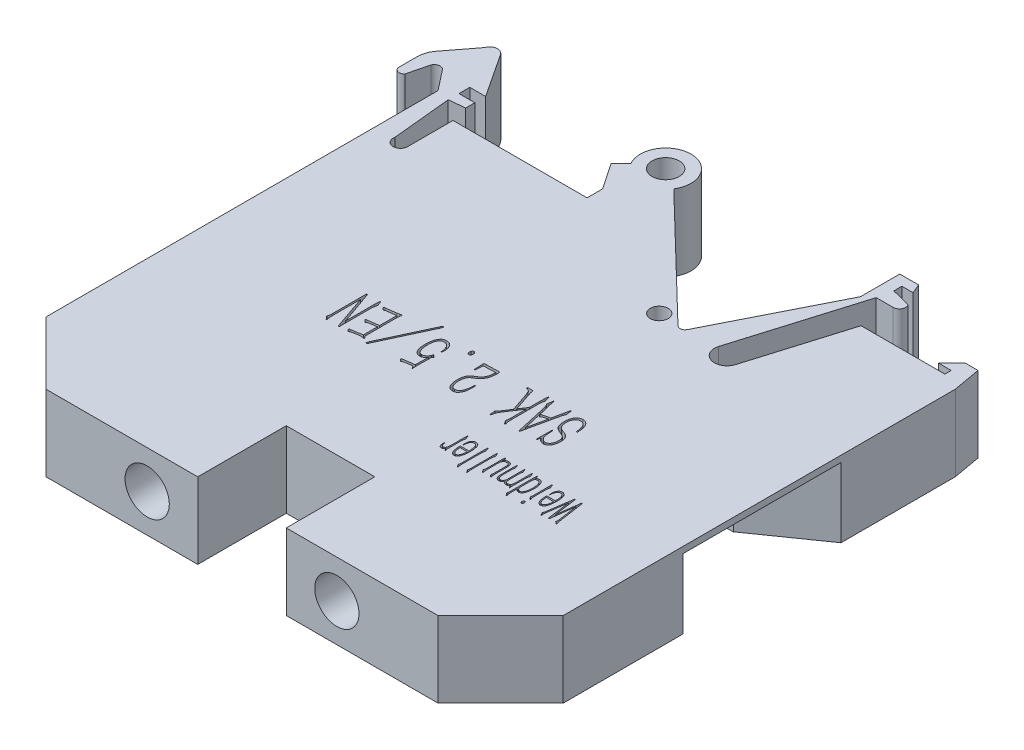
from build123d import *

# Parameters (mm, degrees)
EXTRUDE_1_DEPTH     = 6
SKETCH_2_R          = 1.75
CUT_EXTRUDE_1_DEPTH = 5
SKETCH_3_W          = 0.5
SKETCH_3_H          = 2.824973596
CUT_EXTRUDE_2_DEPTH = 1
SKETCH_4_R          = 1.074642803
CUT_EXTRUDE_3_DEPTH = 49.240761771
SKETCH_5_R          = 0.707865735
CUT_EXTRUDE_4_DEPTH = 49.240761771
SKETCH_6_W          = 12.5
SKETCH_6_H          = 5.5
CUT_EXTRUDE_5_DEPTH = 5
EXTRUDE_2_DEPTH     = 5.5
SKETCH_8_W          = 5.482141003
SKETCH_8_H          = 4.660811604
CUT_EXTRUDE_6_DEPTH = 10
CUT_EXTRUDE_7_DEPTH = 1


with BuildPart() as part:
    # 草图1 → 凸台-拉伸1 (new body)
    with BuildSketch(Plane(origin=(0, 0, 0), x_dir=(1, 0, 0), z_dir=(0, 1, 0))):
        with BuildLine():
            Line((-3.5, 7), (3.5, 7))
            Line((3.5, 7), (3.5, 0))
            Line((3.5, 0), (15.5, 0))
            Line((15.5, 0), (20.449747468, 4.949747468))
            Line((20.449747468, 4.949747468), (20.449747468, 35.949747468))
            Line((20.449747468, 35.949747468), (20.064730394, 38.133287802))
            Line((20.064730394, 38.133287802), (19.064730394, 38.133287802))
            Line((19.064730394, 38.133287802), (18.004070222, 37.072627631))
            Line((18.004070222, 37.072627631), (19.004070222, 37.072627631))
            Line((19.004070222, 37.072627631), (19.004070222, 36.572627631))
            Line((19.004070222, 36.572627631), (12.379866438, 36.572627631))
            Line((12.379866438, 36.572627631), (10.080468168, 28.945457023))
            ThreePointArc((10.080468168, 28.945457023), (8.834388447, 28.276663087), (8.165594511, 29.522742809))
            Line((8.165594511, 29.522742809), (11.052023437, 39.097111093))
            Line((11.052023437, 39.097111093), (12.389611309, 39.097111093))
            ThreePointArc((12.389611309, 39.097111093), (12.830330838, 39.360962207), (12.805913013, 39.874045907))
            Line((12.805913013, 39.874045907), (11.286732691, 40.252893868))
            Line((11.286732691, 40.252893868), (11.286732691, 40.892065664))
            Line((11.286732691, 40.892065664), (12.170224569, 40.892065664))
            Line((12.170224569, 40.892065664), (11.860762457, 41.644557886))
            Line((11.860762457, 41.644557886), (10.368190502, 41.644557886))
            Line((10.368190502, 41.644557886), (10.368190502, 38.538852695))
            Line((10.368190502, 38.538852695), (5.782070188, 29.447590196))
            ThreePointArc((5.782070188, 29.447590196), (5.482003984, 29.228621058), (5.1289267, 29.344049136))
            Line((5.1289267, 29.344049136), (-4.399356342, 38.538852695))
            ThreePointArc((-4.399356342, 38.538852695), (-6.070259894, 41.606700778), (-7.832974006, 38.590668699))
            Line((-7.832974006, 38.590668699), (-8.620624405, 37.8030183))
            Line((-8.620624405, 37.8030183), (-7.212825116, 35.724485999))
            Line((-7.212825116, 35.724485999), (-7.212825116, 34.497763327))
            Line((-7.212825116, 34.497763327), (-17.812825116, 34.497763327))
            Line((-17.812825116, 34.497763327), (-17.812825116, 30.912648315))
            ThreePointArc((-17.812825116, 30.912648315), (-18.450618593, 30.338743648), (-18.954270089, 31.033353076))
            Line((-18.954270089, 31.033353076), (-19.418791581, 35.724485999))
            Line((-19.418791581, 35.724485999), (-18.163465707, 35.848789842))
            Line((-18.163465707, 35.848789842), (-18.163465707, 36.572627631))
            Line((-18.163465707, 36.572627631), (-19.418791581, 36.572627631))
            Line((-19.418791581, 36.572627631), (-19.418791581, 37.429015674))
            Line((-19.418791581, 37.429015674), (-18.163465707, 37.429015674))
            Line((-18.163465707, 37.429015674), (-20.449747468, 40.892065664))
            ThreePointArc((-20.449747468, 40.892065664), (-21.052060742, 41.163300452), (-21.55506542, 40.735123056))
            Line((-21.55506542, 40.735123056), (-23.203821693, 38.590668699))
            ThreePointArc((-23.203821693, 38.590668699), (-23.497332718, 38.042493682), (-23.598768925, 37.429015674))
            Line((-23.598768925, 37.429015674), (-23.598768925, 35.949747468))
            ThreePointArc((-23.598768925, 35.949747468), (-23.303112935, 35.648807164), (-22.900033631, 35.773324657))
            Line((-22.900033631, 35.773324657), (-22.484949258, 37.429015674))
            ThreePointArc((-22.484949258, 37.429015674), (-22.074041412, 37.719654173), (-21.63895448, 37.46664161))
            Line((-21.63895448, 37.46664161), (-20.449747468, 35.949747468))
            Line((-20.449747468, 35.949747468), (-20.449747468, 4.949747468))
            Line((-20.449747468, 4.949747468), (-15.5, 0))
            Line((-15.5, 0), (-3.5, 0))
            Line((-3.5, 0), (-3.5, 7))
        make_face()
    extrude(amount=EXTRUDE_1_DEPTH)

    # 草图2 → 切除-拉伸1 (cut)
    with BuildSketch(Plane.XY):
        with Locations((-7.5, 3)):
            Circle(SKETCH_2_R)
        with Locations((7.5, 3)):
            Circle(SKETCH_2_R)
    extrude(amount=-CUT_EXTRUDE_1_DEPTH, mode=Mode.SUBTRACT)

    # 草图3 → 切除-拉伸2 (cut)
    with BuildSketch(Plane.XY.offset(-5)):
        with Locations((-7.5, 3)):
            Rectangle(SKETCH_3_W, SKETCH_3_H)
        with Locations((7.5, 3)):
            Rectangle(SKETCH_3_W, SKETCH_3_H)
    extrude(amount=-CUT_EXTRUDE_2_DEPTH, mode=Mode.SUBTRACT)

    # 草图4 → 切除-拉伸3 (cut, through all)
    with BuildSketch(Plane(origin=(0, 6, 0), x_dir=(1, 0, 0), z_dir=(0, 1, 0))):
        with Locations(Location((-6.100523508, 39.601264823, 0), (0, 0, 270))):
            Circle(SKETCH_4_R)
    extrude(amount=-CUT_EXTRUDE_3_DEPTH, mode=Mode.SUBTRACT)

    # 草图5 → 切除-拉伸4 (cut, through all)
    with BuildSketch(Plane(origin=(0, 6, 0), x_dir=(1, 0, 0), z_dir=(0, 1, 0))):
        with Locations(Location((3.558550991, 29.433022389, 0), (0, 0, 270))):
            Circle(SKETCH_5_R)
    extrude(amount=-CUT_EXTRUDE_4_DEPTH, mode=Mode.SUBTRACT)

    # 草图6 → 切除-拉伸5 (cut)
    with BuildSketch(Plane.ZY.offset(20.449747468)):
        with Locations((-20.665127281, 2.75)):
            Rectangle(SKETCH_6_W, SKETCH_6_H)
    cut_extrude_5 = extrude(amount=-CUT_EXTRUDE_5_DEPTH, mode=Mode.SUBTRACT)

    # 草图7 → 凸台-拉伸2 (add)
    with BuildSketch(Plane.XZ.offset(-5.5)):
        Polygon((-20.449747468, -26.915127281), (-15.449747468, -26.915127281), (-15.449747468, -23.415127281), align=None)
        Polygon((-20.449747468, -14.415127281), (-15.449747468, -14.415127281), (-15.449747468, -17.915127281), align=None)
    extrude_2 = extrude(amount=EXTRUDE_2_DEPTH)

    # 草图8 → 切除-拉伸6 (cut)
    with BuildSketch(Plane.ZY.offset(15.449747468)):
        with Locations((-20.656197783, 2.330405802)):
            Rectangle(SKETCH_8_W, SKETCH_8_H)
    cut_extrude_6 = extrude(amount=-CUT_EXTRUDE_6_DEPTH, mode=Mode.SUBTRACT)

    # 镜向1: 切除-拉伸5, 凸台-拉伸2, 切除-拉伸6 across plane
    add(cut_extrude_5.mirror(Plane(origin=(0, 0, 0), x_dir=(0, 0, 1), z_dir=(1, 0, 0))), mode=Mode.SUBTRACT)
    add(extrude_2.mirror(Plane(origin=(0, 0, 0), x_dir=(0, 0, 1), z_dir=(1, 0, 0))))
    add(cut_extrude_6.mirror(Plane(origin=(0, 0, 0), x_dir=(0, 0, 1), z_dir=(1, 0, 0))), mode=Mode.SUBTRACT)

    # 草图9 → 切除-拉伸7 (cut)
    # profile 1 of 20: a face of its own
    with BuildSketch(Plane(origin=(0, 6, 0), x_dir=(1, 0, 0), z_dir=(0, 1, 0))):
        with BuildLine():
            Line((13.505399565, 12.891650445), (13.265697118, 11.022190264))
            Line((13.265697118, 11.022190264), (13.187985366, 11.022190264))
            Line((13.187985366, 11.022190264), (12.955397375, 12.876874267))
            Line((12.955397375, 12.876874267), (12.737038296, 11.362042364))
            add(Edge.make_bspline(
                [(12.737038296, 11.362042364), (12.733711925, 11.337624731), (12.727371072, 11.291078929), (12.721778696, 11.223670912), (12.719954495, 11.160658765), (12.719300866, 11.119968674), (12.718978523, 11.099902017)],
                knots=[0, 0, 0, 0, 1.12427698, 2.14313875, 3.084273374, 4, 4, 4, 4], degree=3))
            add(Edge.make_bspline(
                [(12.718978523, 11.099902017), (12.719548138, 11.090782078), (12.720584555, 11.074188339), (12.721694033, 11.051567801), (12.722350657, 11.033686673), (12.722288347, 11.023285111), (12.722262118, 11.018906669)],
                knots=[0, 0, 0, 0, 1.352376053, 2.460649923, 3.352024802, 4, 4, 4, 4], degree=3))
            Line((12.722262118, 11.018906669), (12.733754701, 10.959801956))
            Line((12.733754701, 10.959801956), (12.696540623, 10.937364056))
            Line((12.696540623, 10.937364056), (12.563555018, 11.169952047))
            add(Edge.make_bspline(
                [(12.563555018, 11.169952047), (12.569758445, 11.179420382), (12.579777326, 11.194712273), (12.588290555, 11.214768165), (12.59318102, 11.229761173), (12.597744946, 11.244976582), (12.605973032, 11.264778436), (12.615147166, 11.288469422), (12.624393494, 11.312801549), (12.632047319, 11.334900491), (12.635900448, 11.353527642), (12.636967468, 11.364768944), (12.63743591, 11.369704086)],
                knots=[0, 0, 0, 0, 1.580980541, 2.553371956, 3.037888227, 3.788931859, 4.775305656, 6.036703337, 7.345794211, 8.419835634, 9.306278274, 10, 10, 10, 10], degree=3))
            Line((12.63743591, 11.369704086), (12.929128613, 13.386378783))
            Line((12.929128613, 13.386378783), (12.988233326, 13.386378783))
            Line((12.988233326, 13.386378783), (13.228483039, 11.554132681))
            Line((13.228483039, 11.554132681), (13.479678069, 13.386378783))
            Line((13.479678069, 13.386378783), (13.534951921, 13.386378783))
            Line((13.534951921, 13.386378783), (13.834306347, 11.34015173))
            add(Edge.make_bspline(
                [(13.834306347, 11.34015173), (13.837415332, 11.318960971), (13.844139446, 11.273129592), (13.85571658, 11.215823344), (13.865406975, 11.169890733), (13.872395194, 11.140838356), (13.876713125, 11.117990263), (13.881771423, 11.099983187), (13.887311891, 11.083093076), (13.893994078, 11.063247467), (13.901983098, 11.03866389), (13.908487736, 11.020891068), (13.912018099, 11.011244947)],
                knots=[0, 0, 0, 0, 1.896873338, 4.102558193, 5.176977938, 6.05508091, 6.749164711, 7.235278581, 7.7105282, 8.323718067, 9.090205401, 10, 10, 10, 10], degree=3))
            Line((13.912018099, 11.011244947), (13.933908734, 10.959801956))
            Line((13.933908734, 10.959801956), (13.908187238, 10.922587878))
            Line((13.908187238, 10.922587878), (13.723758643, 11.081294977))
            add(Edge.make_bspline(
                [(13.723758643, 11.081294977), (13.726006512, 11.092592713), (13.730056785, 11.112949294), (13.735283026, 11.143724293), (13.738097179, 11.178652501), (13.738735792, 11.214094748), (13.738224679, 11.250067839), (13.735899125, 11.282930407), (13.731915505, 11.31957422), (13.728720549, 11.345263954), (13.727042239, 11.358758769)],
                knots=[0, 0, 0, 0, 0.990438925, 1.784600986, 2.682008007, 3.999817028, 4.831204135, 5.774318449, 6.830849758, 8, 8, 8, 8], degree=3))
            Line((13.727042239, 11.358758769), (13.505399565, 12.891650445))
        make_face()
    # profile 2 of 20: a face of its own
    with BuildSketch(Plane(origin=(0, 6, 0), x_dir=(1, 0, 0), z_dir=(0, 1, 0))):
        with BuildLine():
            add(Edge.make_bspline(
                [(12.280071302, 12.496524493), (12.279944807, 12.529912995), (12.27969999, 12.594532848), (12.275316684, 12.69134058), (12.265788609, 12.791215207), (12.248919419, 12.877537414), (12.233520397, 12.949029347), (12.218388901, 12.999254276), (12.202873304, 13.04522326), (12.184633202, 13.086338168), (12.164955223, 13.123627376), (12.14023318, 13.15548634), (12.111666473, 13.18253348), (12.079368188, 13.204229957), (12.045161001, 13.220859416), (12.009567378, 13.230732443), (11.973272407, 13.23497908), (11.949153664, 13.232671511), (11.936935608, 13.231502545)],
                knots=[0, 0, 0, 0, 1.762136233, 3.410425077, 5.113895609, 7.051610907, 8.048994725, 8.972184714, 9.818733913, 10.607690534, 11.344639035, 12.037963998, 12.72591947, 13.412255904, 14.084121409, 14.724259383, 15.353736164, 16, 16, 16, 16], degree=3))
            add(Edge.make_bspline(
                [(11.936935608, 13.231502545), (11.919564397, 13.228846427), (11.883874162, 13.223389269), (11.833504081, 13.199302066), (11.787348895, 13.164758673), (11.754132953, 13.12672665), (11.732068861, 13.089161681), (11.715999056, 13.054010403), (11.701783271, 13.012080528), (11.683737094, 12.94837238), (11.666928532, 12.865662562), (11.659706578, 12.798499486), (11.656188221, 12.765779297)],
                knots=[0, 0, 0, 0, 0.884971188, 1.818228493, 2.78716504, 3.788091118, 4.346745266, 4.986743206, 5.739713658, 6.583908749, 8.335764848, 10, 10, 10, 10], degree=3))
            Line((11.656188221, 12.765779297), (11.65235736, 12.68478395))
            Line((11.65235736, 12.68478395), (11.611859686, 12.68478395))
            add(Edge.make_bspline(
                [(11.611859686, 12.68478395), (11.612196479, 12.71378726), (11.612853206, 12.770342079), (11.614309959, 12.854723925), (11.620934048, 12.939049502), (11.629907034, 13.025452777), (11.649581555, 13.112218304), (11.677051162, 13.181625606), (11.706169225, 13.232039103), (11.729365932, 13.266595562), (11.756077437, 13.295636056), (11.784697047, 13.321112619), (11.817810867, 13.341187327), (11.855510523, 13.356023274), (11.898218616, 13.365218751), (11.928316477, 13.367254714), (11.944050064, 13.36831901)],
                knots=[0, 0, 0, 0, 1.433882338, 2.795989598, 4.170221094, 5.614190475, 7.086267868, 8.554805811, 9.281813015, 9.962194722, 10.606987156, 11.227094241, 11.850340467, 12.51009238, 13.221154258, 14, 14, 14, 14], degree=3))
            add(Edge.make_bspline(
                [(11.944050064, 13.36831901), (11.957741383, 13.368870546), (11.985583558, 13.369992129), (12.02908748, 13.364566022), (12.076655437, 13.352352104), (12.118027666, 13.333325187), (12.153486541, 13.313297166), (12.180538231, 13.29289488), (12.205901762, 13.267266823), (12.231753675, 13.238063372), (12.256173403, 13.202543774), (12.277936411, 13.159234225), (12.297287113, 13.108337381), (12.320206016, 13.030504239), (12.34379701, 12.926935818), (12.361841935, 12.818913631), (12.37110737, 12.72576517), (12.376147144, 12.645089963), (12.377294797, 12.553804926), (12.376702278, 12.489408472), (12.376390094, 12.455479554)],
                knots=[0, 0, 0, 0, 0.650892177, 1.323630895, 2.077151028, 2.978514147, 3.480102479, 4.012921675, 4.583614278, 5.192607284, 5.86657618, 6.6272577, 7.49264712, 8.453494528, 10.484783578, 12.541987508, 13.658458761, 14.936482626, 16.385907541, 18, 18, 18, 18], degree=3))
            add(Edge.make_bspline(
                [(12.376390094, 12.455479554), (12.375506397, 12.430487192), (12.373803139, 12.382316319), (12.370886178, 12.31276171), (12.365831892, 12.248543053), (12.357930206, 12.171467156), (12.346469765, 12.082902784), (12.325846099, 11.983576197), (12.298877446, 11.88880542), (12.26783836, 11.813314099), (12.238779259, 11.755354022), (12.213075573, 11.717244644), (12.18376046, 11.685189829), (12.152078125, 11.658909828), (12.119202738, 11.638530183), (12.087438081, 11.621903426), (12.056537093, 11.609296541), (12.035704803, 11.60458102), (12.025592677, 11.602292077)],
                knots=[0, 0, 0, 0, 1.213254056, 2.338454759, 3.376961, 4.337703347, 6.097447331, 7.706415981, 9.255161951, 10.870664585, 11.658362253, 12.397216084, 13.092544982, 13.758825418, 14.387360726, 14.965258123, 15.497729695, 16, 16, 16, 16], degree=3))
            add(Edge.make_bspline(
                [(12.025592677, 11.602292077), (12.010827386, 11.600570985), (11.981405757, 11.597141502), (11.936495104, 11.603271961), (11.89225562, 11.617984673), (11.848866782, 11.640318067), (11.808284185, 11.669675435), (11.771867812, 11.704643288), (11.73968532, 11.744052299), (11.705337875, 11.80386069), (11.671878479, 11.883893684), (11.643539095, 11.981738196), (11.626591931, 12.07486873), (11.613160698, 12.157694313), (11.60622965, 12.229603051), (11.599663543, 12.293194043), (11.598230288, 12.352766116), (11.596799939, 12.400581251), (11.59732776, 12.435965781), (11.598788106, 12.457097031), (11.60127095, 12.472228141), (11.604864743, 12.484135836), (11.615592556, 12.491030155), (11.631790237, 12.493707559), (11.654445589, 12.49673633), (11.672041664, 12.496600608), (11.681909717, 12.496524493)],
                knots=[0, 0, 0, 0, 0.906605631, 1.806521371, 2.745464054, 3.748872433, 4.780444398, 5.79888872, 6.830883324, 7.881839338, 10.007036246, 12.12292051, 14.101853907, 15.795734178, 17.255194944, 18.521439439, 19.705462147, 20.900013433, 21.447069289, 21.872548139, 22.190030376, 22.395242738, 22.602869447, 22.92502652, 23.397144282, 24, 24, 24, 24], degree=3))
            Line((11.681909717, 12.496524493), (12.280071302, 12.496524493))
        make_face()
        with BuildLine():
            add(Edge.make_bspline(
                [(11.700516756, 12.370653345), (11.700844419, 12.345472559), (11.70151947, 12.293595121), (11.706912225, 12.213132181), (11.71862078, 12.126009542), (11.734685786, 12.050103677), (11.750314976, 11.988349929), (11.765050627, 11.945809496), (11.779718695, 11.907593378), (11.802031016, 11.864353224), (11.834955774, 11.818920213), (11.87348941, 11.781253911), (11.907801097, 11.759376132), (11.934070607, 11.748050951), (11.960928554, 11.740168811), (11.979202333, 11.739462979), (11.988378599, 11.739108542)],
                knots=[0, 0, 0, 0, 1.401498202, 2.887365554, 4.485580624, 6.289686032, 7.203377874, 8.028555173, 8.794042308, 9.479752962, 10.730887343, 11.901700773, 12.453824643, 12.985788389, 13.490708791, 14, 14, 14, 14], degree=3))
            add(Edge.make_bspline(
                [(11.988378599, 11.739108542), (11.999962245, 11.740492863), (12.022918374, 11.743236268), (12.056290682, 11.75532419), (12.08762894, 11.77433336), (12.117026446, 11.799621301), (12.143721946, 11.830359748), (12.167132405, 11.865618193), (12.18777259, 11.904708495), (12.209128494, 11.963718578), (12.231234866, 12.04289855), (12.247874548, 12.12482695), (12.258811357, 12.190480423), (12.264972121, 12.236632685), (12.268395223, 12.279206886), (12.268889291, 12.306253192), (12.269125985, 12.319210355)],
                knots=[0, 0, 0, 0, 0.702215769, 1.39163045, 2.122264132, 2.903167055, 3.72231811, 4.571112816, 5.452477709, 6.382741783, 8.35153412, 10.409057006, 11.4243454, 12.367867756, 13.218089009, 14, 14, 14, 14], degree=3))
            Line((12.269125985, 12.319210355), (12.272956846, 12.370653345))
            Line((12.272956846, 12.370653345), (11.700516756, 12.370653345))
        make_face(mode=Mode.SUBTRACT)
    # profile 3 of 20: a face of its own
    with BuildSketch(Plane(origin=(0, 6, 0), x_dir=(1, 0, 0), z_dir=(0, 1, 0))):
        with BuildLine():
            Line((11.205241152, 11.620899116), (11.175688795, 11.583685038))
            Line((11.175688795, 11.583685038), (11.009867239, 11.798213255))
            add(Edge.make_bspline(
                [(11.009867239, 11.798213255), (11.01428844, 11.810363576), (11.022191368, 11.83208236), (11.030840739, 11.865840369), (11.037693272, 11.904304796), (11.044232197, 11.94330113), (11.049230504, 11.982728143), (11.051226909, 12.018550134), (11.051775476, 12.058354514), (11.05084926, 12.086259114), (11.050364913, 12.100851276)],
                knots=[0, 0, 0, 0, 1.009205721, 1.803962369, 2.717641552, 4.059708212, 4.892013242, 5.81980073, 6.859907636, 8, 8, 8, 8], degree=3))
            Line((11.050364913, 12.100851276), (11.046534052, 13.139014614))
            Line((11.046534052, 13.139014614), (11.046534052, 13.272000218))
            add(Edge.make_bspline(
                [(11.046534052, 13.272000218), (11.046644566, 13.299253249), (11.046847332, 13.349255677), (11.052295948, 13.407449017), (11.056014677, 13.446018115), (11.062125003, 13.463097806), (11.064380358, 13.476777325), (11.070243544, 13.478332903), (11.072255548, 13.478866714)],
                knots=[0, 0, 0, 0, 2.301498112, 4.222667704, 4.987065429, 5.515302984, 5.83367201, 6, 6, 6, 6], degree=3))
            add(Edge.make_bspline(
                [(11.072255548, 13.478866714), (11.074765612, 13.478589709), (11.080202407, 13.477989717), (11.086668405, 13.469822099), (11.094356744, 13.456865108), (11.103829121, 13.437244467), (11.115816904, 13.414728247), (11.121519551, 13.398139969), (11.124245804, 13.390209644)],
                knots=[0, 0, 0, 0, 0.413918326, 0.896546128, 1.662794511, 3.022573531, 4.576587735, 6, 6, 6, 6], degree=3))
            Line((11.124245804, 13.390209644), (11.168574339, 13.25722404))
            add(Edge.make_bspline(
                [(11.168574339, 13.25722404), (11.171842068, 13.248461919), (11.177691198, 13.232778006), (11.18549236, 13.212464732), (11.190159444, 13.197638675), (11.195010896, 13.186233039), (11.197466316, 13.173113287), (11.195450046, 13.163261373), (11.194295835, 13.157621653)],
                knots=[0, 0, 0, 0, 1.610684889, 2.88307366, 3.747535533, 4.284430495, 5.017923802, 6, 6, 6, 6], degree=3))
            add(Edge.make_bspline(
                [(11.194295835, 13.157621653), (11.193482427, 13.153397893), (11.19112778, 13.141170967), (11.182520028, 13.120663203), (11.173454307, 13.094662717), (11.163748814, 13.066162929), (11.158126078, 13.03316022), (11.153390825, 12.997022864), (11.151124674, 12.961180383), (11.14989888, 12.935439446), (11.149981653, 12.918101397), (11.149960995, 12.904784927), (11.149969709, 12.886907435), (11.149966428, 12.864287166), (11.149967596, 12.837106276), (11.149967202, 12.805182441), (11.149967329, 12.768698048), (11.14996731, 12.742794131), (11.1499673, 12.729112484)],
                knots=[0, 0, 0, 0, 0.474563025, 1.37376325, 2.445211898, 3.522902599, 4.693355563, 6.136330548, 7.551283934, 8.660940665, 8.98353668, 9.467430702, 10.132784982, 10.95943727, 11.967549816, 13.136960369, 14.487831181, 16, 16, 16, 16], degree=3))
            Line((11.1499673, 12.729112484), (11.1499673, 12.075129781))
            add(Edge.make_bspline(
                [(11.1499673, 12.075129781), (11.15012521, 12.068197016), (11.150536827, 12.050125744), (11.152213389, 12.016904996), (11.155923318, 11.971535503), (11.159043685, 11.918033876), (11.163452853, 11.864435336), (11.16669943, 11.818746723), (11.170952454, 11.785084464), (11.174231811, 11.754590687), (11.181891311, 11.721036105), (11.187414384, 11.694603499), (11.190464974, 11.680003829)],
                knots=[0, 0, 0, 0, 0.522936528, 1.36311098, 2.507898653, 3.955561121, 5.404203704, 6.56377404, 7.408441435, 7.962992748, 8.874888268, 10, 10, 10, 10], degree=3))
            Line((11.190464974, 11.680003829), (11.205241152, 11.620899116))
        make_face()
    # profile 4 of 20: a face of its own
    with BuildSketch(Plane(origin=(0, 6, 0), x_dir=(1, 0, 0), z_dir=(0, 1, 0))):
        with BuildLine():
            add(Edge.make_bspline(
                [(11.190464974, 11.148061412), (11.19021508, 11.13893297), (11.1896183, 11.117133022), (11.185488655, 11.082217394), (11.177451857, 11.044684086), (11.163972541, 11.016075273), (11.148425757, 10.997687809), (11.132344026, 10.989547762), (11.113300672, 10.985696371), (11.092480483, 10.986648741), (11.071149911, 10.9906585), (11.053058104, 11.002041198), (11.037568855, 11.016984142), (11.023447496, 11.044752267), (11.012037144, 11.085169697), (11.010610313, 11.119327299), (11.009867239, 11.137116095)],
                knots=[0, 0, 0, 0, 0.947030444, 2.26163592, 3.643325183, 4.912884611, 5.502315166, 6.10347833, 6.741915126, 7.499170639, 8.25666261, 8.960985277, 9.683631172, 10.463029917, 12.157996094, 14, 14, 14, 14], degree=3))
            add(Edge.make_bspline(
                [(11.009867239, 11.137116095), (11.012873274, 11.154426511), (11.018528434, 11.186992059), (11.033667952, 11.224413427), (11.050265411, 11.248859385), (11.067464549, 11.260593316), (11.087680062, 11.267064886), (11.101941863, 11.266545163), (11.109469626, 11.266270838)],
                knots=[0, 0, 0, 0, 1.727880391, 3.250607675, 3.944616269, 4.60301063, 5.262631281, 6, 6, 6, 6], degree=3))
            add(Edge.make_bspline(
                [(11.109469626, 11.266270838), (11.11590217, 11.26585001), (11.128169295, 11.265047473), (11.145405244, 11.25892499), (11.15967819, 11.247848614), (11.175097612, 11.227255513), (11.188430684, 11.193367726), (11.189753973, 11.163896323), (11.190464974, 11.148061412)],
                knots=[0, 0, 0, 0, 0.719617656, 1.372340468, 2.013778014, 2.712507146, 4.233638419, 6, 6, 6, 6], degree=3))
        make_face()
    # profile 5 of 20: a face of its own
    with BuildSketch(Plane(origin=(0, 6, 0), x_dir=(1, 0, 0), z_dir=(0, 1, 0))):
        with BuildLine():
            add(Edge.make_bspline(
                [(9.960211318, 13.231502545), (9.966582614, 13.237716543), (9.97812757, 13.248976471), (9.994117351, 13.264237107), (10.007738971, 13.275375311), (10.023082873, 13.288148832), (10.047885933, 13.300438151), (10.083828754, 13.313544723), (10.125993454, 13.325643063), (10.156060868, 13.329299379), (10.170908675, 13.331104931)],
                knots=[0, 0, 0, 0, 0.892903414, 1.617964525, 2.215417032, 2.658386297, 3.616416726, 4.965704087, 6.501612377, 8, 8, 8, 8], degree=3))
            add(Edge.make_bspline(
                [(10.170908675, 13.331104931), (10.182027555, 13.331884885), (10.204820798, 13.333483757), (10.239673556, 13.331452968), (10.275264061, 13.3236308), (10.310939858, 13.313273267), (10.344782772, 13.299165694), (10.375489812, 13.283150354), (10.400875459, 13.263120448), (10.429501398, 13.232417721), (10.461294074, 13.186677232), (10.4965831, 13.125174152), (10.530273531, 13.05831119), (10.553595275, 12.998933231), (10.569181811, 12.947782119), (10.579753539, 12.903681402), (10.590423241, 12.853567064), (10.601995742, 12.780042841), (10.614838365, 12.687580365), (10.618334904, 12.57844447), (10.616544352, 12.472374148), (10.612435056, 12.402202709), (10.610363161, 12.366822484)],
                knots=[0, 0, 0, 0, 0.561379099, 1.150803861, 1.751094182, 2.393799424, 3.020261351, 3.596127638, 4.133043624, 4.640179281, 5.706589635, 6.929966163, 8.212514216, 9.475646454, 10.138605952, 10.905504014, 11.75999789, 12.719564715, 14.655464655, 16.458562752, 18.214418182, 20, 20, 20, 20], degree=3))
            add(Edge.make_bspline(
                [(10.610363161, 12.366822484), (10.607099454, 12.317133734), (10.600797801, 12.221193342), (10.582859902, 12.104958062), (10.563940236, 12.020029883), (10.550045829, 11.963248109), (10.534338251, 11.912618105), (10.512198533, 11.854510085), (10.480848637, 11.79122651), (10.443096146, 11.735903679), (10.409222599, 11.699583693), (10.383057152, 11.677039958), (10.355254771, 11.658742522), (10.326002373, 11.644057747), (10.293946174, 11.634390723), (10.259505363, 11.627619998), (10.221609351, 11.625645266), (10.195527335, 11.627199024), (10.181853992, 11.628013572)],
                knots=[0, 0, 0, 0, 2.497356063, 4.821963015, 5.890034002, 6.862213378, 7.753728528, 8.547439322, 9.979886657, 11.287408761, 11.889537581, 12.467247448, 13.015502132, 13.555754915, 14.102786156, 14.689700842, 15.31308335, 16, 16, 16, 16], degree=3))
            add(Edge.make_bspline(
                [(10.181853992, 11.628013572), (10.16922668, 11.630942004), (10.143450239, 11.636919882), (10.104129693, 11.649579732), (10.064072505, 11.67239877), (10.028530798, 11.706299771), (9.99862703, 11.740714162), (9.981827644, 11.763296847), (9.974987497, 11.77249176)],
                knots=[0, 0, 0, 0, 0.896673248, 1.83040095, 2.84769195, 4.053811443, 5.207577174, 6, 6, 6, 6], degree=3))
            Line((9.974987497, 11.77249176), (9.956380457, 11.809158572))
            Line((9.956380457, 11.809158572), (9.956380457, 11.39159472))
            add(Edge.make_bspline(
                [(9.956380457, 11.39159472), (9.956261617, 11.375175171), (9.956037109, 11.344155907), (9.957528923, 11.300019917), (9.958323827, 11.260965166), (9.960613946, 11.215148737), (9.964784903, 11.16016178), (9.971110997, 11.106211592), (9.976777774, 11.064998617), (9.981000887, 11.039416891), (9.985242622, 11.019689595), (9.988441921, 11.008679279), (9.989763675, 11.004130491)],
                knots=[0, 0, 0, 0, 1.263431071, 2.38683181, 3.39796654, 4.269348467, 5.916661042, 7.640551694, 8.448567324, 9.117848733, 9.635549129, 10, 10, 10, 10], degree=3))
            Line((9.989763675, 11.004130491), (10.008370714, 10.945025778))
            Line((10.008370714, 10.945025778), (9.974987497, 10.907811699))
            Line((9.974987497, 10.907811699), (9.808618675, 11.125623512))
            add(Edge.make_bspline(
                [(9.808618675, 11.125623512), (9.813185389, 11.138149935), (9.821392787, 11.160662698), (9.83073094, 11.194474588), (9.839646762, 11.229242618), (9.847025579, 11.26295258), (9.852031378, 11.297704683), (9.853842807, 11.333012643), (9.854335384, 11.376276272), (9.853435951, 11.407831291), (9.85294721, 11.424977938)],
                knots=[0, 0, 0, 0, 1.048359807, 1.884135396, 2.757739103, 3.872270807, 4.596784634, 5.516997527, 6.650764085, 8, 8, 8, 8], degree=3))
            Line((9.85294721, 11.424977938), (9.85294721, 13.142845475))
            Line((9.85294721, 13.142845475), (9.860608932, 13.34971197))
            add(Edge.make_bspline(
                [(9.860608932, 13.34971197), (9.860931886, 13.366727283), (9.861518357, 13.397626319), (9.866949146, 13.433440792), (9.873115423, 13.45613102), (9.876714541, 13.466185207), (9.881518473, 13.473176636), (9.884993773, 13.472147918), (9.886330427, 13.471752257)],
                knots=[0, 0, 0, 0, 2.345488946, 4.259301401, 5.017308716, 5.536758502, 5.821830193, 6, 6, 6, 6], degree=3))
            add(Edge.make_bspline(
                [(9.886330427, 13.471752257), (9.888013591, 13.47129057), (9.892855645, 13.469962406), (9.90109125, 13.462508736), (9.911784951, 13.446531262), (9.917648865, 13.425855378), (9.923656101, 13.407332746), (9.927476596, 13.39591097), (9.930032947, 13.388302166), (9.930504738, 13.384377971), (9.930658962, 13.383095188)],
                knots=[0, 0, 0, 0, 0.404869445, 1.164711592, 2.514276409, 4.876978618, 6.132146454, 7.076841826, 7.698228133, 8, 8, 8, 8], degree=3))
            Line((9.930658962, 13.383095188), (9.956380457, 13.338766653))
            add(Edge.make_bspline(
                [(9.956380457, 13.338766653), (9.960071251, 13.332298298), (9.966830087, 13.320453001), (9.973086507, 13.30259168), (9.975653547, 13.28617886), (9.97259152, 13.276524371), (9.971156636, 13.272000218)],
                knots=[0, 0, 0, 0, 1.258222532, 2.304143687, 3.20531149, 4, 4, 4, 4], degree=3))
            Line((9.971156636, 13.272000218), (9.960211318, 13.231502545))
        make_face()
        with BuildLine():
            add(Edge.make_bspline(
                [(9.956380457, 12.038462968), (9.959813546, 12.023862022), (9.967703182, 11.99030735), (9.978834219, 11.946054061), (9.993352769, 11.906237308), (10.011791802, 11.875547399), (10.035151513, 11.845290648), (10.063457806, 11.8159712), (10.095158313, 11.789512372), (10.130550043, 11.76892493), (10.167912611, 11.753626664), (10.194319052, 11.748697509), (10.207575487, 11.746222998)],
                knots=[0, 0, 0, 0, 1.086611702, 2.497159991, 3.30457702, 4.14547401, 5.078516649, 6.069205026, 7.09292393, 8.058437083, 9.02530585, 10, 10, 10, 10], degree=3))
            add(Edge.make_bspline(
                [(10.207575487, 11.746222998), (10.224835676, 11.746352504), (10.257800602, 11.746599843), (10.305657282, 11.762898504), (10.346967465, 11.795650447), (10.384276444, 11.842243376), (10.419005098, 11.901707229), (10.442340731, 11.960936057), (10.460288776, 12.014712573), (10.472560938, 12.06197662), (10.484568989, 12.114542769), (10.500265895, 12.193402652), (10.515554258, 12.300775474), (10.519571121, 12.411838116), (10.52018313, 12.50035253), (10.519914641, 12.56075784), (10.517770634, 12.614052117), (10.515226258, 12.647028288), (10.51404437, 12.662346049)],
                knots=[0, 0, 0, 0, 0.783422298, 1.496244245, 2.256452178, 3.154187111, 4.205501914, 5.38401544, 6.049455705, 6.789887053, 7.609051376, 8.507826, 10.455721077, 12.545761308, 13.568829603, 14.492093311, 15.29956228, 16, 16, 16, 16], degree=3))
            add(Edge.make_bspline(
                [(10.51404437, 12.662346049), (10.51087347, 12.701314196), (10.50480136, 12.77593621), (10.486039954, 12.865695601), (10.467892666, 12.931641511), (10.451302763, 12.976265265), (10.43335843, 13.017744379), (10.413086056, 13.055357544), (10.391581547, 13.089390993), (10.367781161, 13.118658459), (10.342715644, 13.143631864), (10.315499402, 13.163536835), (10.286666737, 13.179245548), (10.255803573, 13.190090114), (10.223018571, 13.196962703), (10.200496163, 13.19772775), (10.188968448, 13.198119327)],
                knots=[0, 0, 0, 0, 2.382793278, 4.562927645, 5.580907709, 6.552522086, 7.464308584, 8.335538392, 9.156573158, 9.916028481, 10.632097862, 11.308690416, 11.965880084, 12.627576248, 13.297548003, 14, 14, 14, 14], degree=3))
            add(Edge.make_bspline(
                [(10.188968448, 13.198119327), (10.177819981, 13.198463875), (10.156901021, 13.199110384), (10.127207521, 13.194817288), (10.100629249, 13.188627671), (10.072188105, 13.172595234), (10.041965188, 13.150043827), (10.013177132, 13.11763656), (9.990992111, 13.082203819), (9.973563943, 13.050314211), (9.964347777, 13.017563659), (9.960115647, 12.982975243), (9.956780449, 12.938779615), (9.956522285, 12.905888876), (9.956380457, 12.887819584)],
                knots=[0, 0, 0, 0, 0.902600324, 1.69363726, 2.42946763, 3.097945681, 4.323128942, 5.475755007, 6.587972891, 7.712913435, 8.405994385, 9.333006651, 10.534825171, 12, 12, 12, 12], degree=3))
            Line((9.956380457, 12.887819584), (9.956380457, 12.038462968))
        make_face(mode=Mode.SUBTRACT)
    # profile 6 of 20: a face of its own
    with BuildSketch(Plane(origin=(0, 6, 0), x_dir=(1, 0, 0), z_dir=(0, 1, 0))):
        with BuildLine():
            add(Edge.make_bspline(
                [(8.960903857, 11.812989433), (8.947769964, 11.796601897), (8.922607858, 11.76520641), (8.883266572, 11.722179635), (8.841023627, 11.6862117), (8.792976251, 11.659604527), (8.738812071, 11.64142165), (8.700186836, 11.637637624), (8.68015647, 11.635675294)],
                knots=[0, 0, 0, 0, 1.096444177, 2.100584122, 3.040890774, 3.979023861, 4.951957435, 6, 6, 6, 6], degree=3))
            add(Edge.make_bspline(
                [(8.68015647, 11.635675294), (8.65875778, 11.636483918), (8.616953571, 11.638063634), (8.565871303, 11.649268149), (8.528072425, 11.66473593), (8.50089758, 11.680196827), (8.475242549, 11.700205098), (8.442173145, 11.731703645), (8.406632277, 11.779383043), (8.376211704, 11.847800441), (8.355674132, 11.927626501), (8.340485225, 12.017911514), (8.331449784, 12.115631328), (8.330056352, 12.182376568), (8.329359053, 12.215777107)],
                knots=[0, 0, 0, 0, 0.999941217, 1.953472534, 2.423751282, 2.904956654, 3.409757135, 3.94046504, 5.03698677, 6.162529902, 7.418141914, 8.880198513, 10.438794251, 12, 12, 12, 12], degree=3))
            Line((8.329359053, 12.215777107), (8.329359053, 12.843491049))
            add(Edge.make_bspline(
                [(8.329359053, 12.843491049), (8.329272566, 12.864287863), (8.329089717, 12.908255931), (8.330634091, 12.97775147), (8.331446014, 13.054193142), (8.333109224, 13.13390763), (8.334981559, 13.209788719), (8.335389451, 13.274547645), (8.335530972, 13.324553377), (8.335010447, 13.361175375), (8.33411309, 13.387942416), (8.336739719, 13.407581186), (8.338911947, 13.422573235), (8.346340519, 13.433959514), (8.354903514, 13.441080917), (8.366808919, 13.445827181), (8.376125824, 13.435205498), (8.380328501, 13.422353452), (8.38689733, 13.405148643), (8.392926556, 13.383496661), (8.401234054, 13.354268468), (8.407437724, 13.332380945), (8.410901666, 13.320159614)],
                knots=[0, 0, 0, 0, 1.668298848, 3.527072747, 5.576069855, 7.800901526, 9.923314704, 11.664846041, 12.996558279, 13.933261429, 14.606434648, 15.136507932, 15.526997104, 15.803114645, 16.198508968, 16.439862384, 16.709703707, 17.174785872, 17.563626243, 18.174768394, 18.980845872, 20, 20, 20, 20], degree=3))
            Line((8.410901666, 13.320159614), (8.447568479, 13.201950188))
            add(Edge.make_bspline(
                [(8.447568479, 13.201950188), (8.450136307, 13.194475006), (8.454747869, 13.181050323), (8.460852185, 13.162691141), (8.463404743, 13.147637953), (8.46265531, 13.13883339), (8.462344657, 13.135183753)],
                knots=[0, 0, 0, 0, 1.374116915, 2.467777289, 3.364868378, 4, 4, 4, 4], degree=3))
            Line((8.462344657, 13.135183753), (8.447568479, 13.105631397))
            add(Edge.make_bspline(
                [(8.447568479, 13.105631397), (8.447411109, 13.103621866), (8.446993744, 13.098292346), (8.445154564, 13.088049284), (8.441630283, 13.073586072), (8.438056285, 13.05437757), (8.433093286, 13.030465247), (8.430420572, 13.001128321), (8.427532287, 12.966480801), (8.426325248, 12.941640514), (8.425677845, 12.928317258)],
                knots=[0, 0, 0, 0, 0.270203735, 0.716613359, 1.393229182, 2.266393835, 3.336357224, 4.665493798, 6.211515061, 8, 8, 8, 8], degree=3))
            Line((8.425677845, 12.928317258), (8.421846984, 12.23383688))
            add(Edge.make_bspline(
                [(8.421846984, 12.23383688), (8.42198991, 12.226538843), (8.422322459, 12.209558452), (8.424000191, 12.180341199), (8.427660123, 12.14409977), (8.43210859, 12.08811507), (8.440888851, 12.01930865), (8.452310772, 11.953576019), (8.467044608, 11.906161548), (8.484217835, 11.873195225), (8.507830189, 11.841968157), (8.535525918, 11.812103774), (8.568394797, 11.786519187), (8.606534907, 11.769911425), (8.648297182, 11.761793473), (8.676850682, 11.763793492), (8.691649053, 11.764830038)],
                knots=[0, 0, 0, 0, 0.497562013, 1.157680726, 1.994170897, 2.980397863, 4.985507961, 6.721895191, 7.520170795, 8.359981849, 9.240423141, 10.181642739, 11.131692595, 12.055919028, 12.992444645, 14, 14, 14, 14], degree=3))
            add(Edge.make_bspline(
                [(8.691649053, 11.764830038), (8.703992515, 11.766934231), (8.728157267, 11.771053602), (8.76159545, 11.784695441), (8.791898756, 11.802117518), (8.825653241, 11.832479847), (8.859689529, 11.876036634), (8.882569313, 11.920559321), (8.893472047, 11.954221287), (8.897202848, 11.977650994), (8.901188449, 12.006639085), (8.904369617, 12.041148792), (8.906360877, 12.081498744), (8.907990335, 12.127292299), (8.909062262, 12.178740869), (8.909323606, 12.214864483), (8.909460866, 12.23383688)],
                knots=[0, 0, 0, 0, 0.915191754, 1.791667652, 2.630944826, 3.464879635, 5.102024415, 6.656721008, 7.104991814, 7.689801808, 8.39135468, 9.250838009, 10.228370398, 11.352233425, 12.609372812, 14, 14, 14, 14], degree=3))
            Line((8.909460866, 12.23383688), (8.909460866, 13.201950188))
            add(Edge.make_bspline(
                [(8.909460866, 13.201950188), (8.909408637, 13.21563214), (8.909309049, 13.241720403), (8.909973103, 13.278568642), (8.910588371, 13.311219165), (8.910837732, 13.339328547), (8.91220374, 13.363212473), (8.912957791, 13.382761803), (8.914712749, 13.398105425), (8.916557863, 13.411805598), (8.919799048, 13.424157154), (8.92322475, 13.432921091), (8.92672338, 13.440648281), (8.929979638, 13.43904465), (8.9313515, 13.43836904)],
                knots=[0, 0, 0, 0, 2.017948922, 3.847753773, 5.435434925, 6.834804866, 7.993013013, 8.963122121, 9.720801556, 10.26494144, 11.015420717, 11.535061612, 11.804121468, 12, 12, 12, 12], degree=3))
            add(Edge.make_bspline(
                [(8.9313515, 13.43836904), (8.933235112, 13.437939105), (8.938330961, 13.436775974), (8.944976879, 13.430221961), (8.953081893, 13.422237794), (8.956677903, 13.411637443), (8.960259307, 13.401014736), (8.964042597, 13.388696813), (8.96959789, 13.372556382), (8.973517864, 13.360302048), (8.975680035, 13.353542832)],
                knots=[0, 0, 0, 0, 0.45949356, 1.243096057, 2.178793402, 3.184338218, 3.880221149, 4.896305551, 6.288071414, 8, 8, 8, 8], degree=3))
            Line((8.975680035, 13.353542832), (9.020008569, 13.227671684))
            add(Edge.make_bspline(
                [(9.020008569, 13.227671684), (9.024241913, 13.216007979), (9.0316248, 13.195666655), (9.040795175, 13.169033468), (9.045932697, 13.150410566), (9.046343842, 13.135206244), (9.040918564, 13.121514382), (9.034073062, 13.104142058), (9.026222172, 13.081358157), (9.01869752, 13.057796967), (9.014027818, 13.03258643), (9.010672777, 13.007040988), (9.009366155, 12.97539388), (9.009170393, 12.952396411), (9.009063252, 12.939809841)],
                knots=[0, 0, 0, 0, 1.5034995, 2.622080407, 3.415812386, 3.835862416, 4.437262216, 5.172162743, 6.109078592, 7.354206619, 8.164996951, 9.212500715, 10.474394959, 12, 12, 12, 12], degree=3))
            Line((9.009063252, 12.939809841), (9.005232391, 12.23383688))
            add(Edge.make_bspline(
                [(9.005232391, 12.23383688), (9.005397805, 12.225992336), (9.005771035, 12.208292414), (9.006835298, 12.178543475), (9.009078877, 12.14259961), (9.01240284, 12.102303805), (9.015558946, 12.061156445), (9.021130982, 12.022984377), (9.024859239, 11.989059759), (9.032038333, 11.9504467), (9.045894963, 11.90619684), (9.071805081, 11.857869771), (9.10866812, 11.816143473), (9.154822458, 11.788481472), (9.199489328, 11.769844636), (9.228945514, 11.766341215), (9.241651243, 11.764830038)],
                knots=[0, 0, 0, 0, 0.564263654, 1.273167999, 2.140601696, 3.15381629, 4.181200047, 5.107079579, 5.92719219, 6.63476001, 7.929213633, 9.244244738, 10.553833273, 11.874936045, 13.083367819, 14, 14, 14, 14], degree=3))
            add(Edge.make_bspline(
                [(9.241651243, 11.764830038), (9.247716687, 11.765934501), (9.260664061, 11.768292104), (9.28079716, 11.775994853), (9.30314046, 11.786965877), (9.335045908, 11.806374267), (9.372138291, 11.833811064), (9.410094426, 11.872723904), (9.437298949, 11.921133242), (9.455149347, 11.977679986), (9.467972066, 12.037557223), (9.469991339, 12.078172119), (9.470955639, 12.097567681)],
                knots=[0, 0, 0, 0, 0.421513652, 0.89976844, 1.46977067, 2.125496788, 3.454980159, 4.621786436, 5.819820438, 7.218604604, 8.671750271, 10, 10, 10, 10], degree=3))
            Line((9.470955639, 12.097567681), (9.4747865, 13.031750505))
            add(Edge.make_bspline(
                [(9.4747865, 13.031750505), (9.474638737, 13.051453901), (9.474362337, 13.08831043), (9.47614182, 13.139736466), (9.476006113, 13.183545722), (9.478395694, 13.230631706), (9.482134188, 13.281325751), (9.486861597, 13.335019656), (9.491679057, 13.378352493), (9.49364719, 13.41086548), (9.496892658, 13.43049928), (9.500062725, 13.444300156), (9.510625912, 13.447190342), (9.515975865, 13.444045303), (9.519115035, 13.442199901)],
                knots=[0, 0, 0, 0, 1.641540351, 3.07061179, 4.286662599, 5.290861938, 6.997537254, 8.523625385, 9.77589754, 10.645592883, 11.200320669, 11.499715067, 11.706449906, 12, 12, 12, 12], degree=3))
            add(Edge.make_bspline(
                [(9.519115035, 13.442199901), (9.523778296, 13.440084024), (9.534175139, 13.43536663), (9.540451882, 13.414747618), (9.547918185, 13.387825186), (9.55524679, 13.366341469), (9.559612708, 13.353542832)],
                knots=[0, 0, 0, 0, 0.58625696, 1.307072739, 2.395724582, 4, 4, 4, 4], degree=3))
            Line((9.559612708, 13.353542832), (9.603941243, 13.227671684))
            add(Edge.make_bspline(
                [(9.603941243, 13.227671684), (9.607701542, 13.216576296), (9.614446928, 13.196672912), (9.621926826, 13.169983221), (9.627113352, 13.150376906), (9.628110306, 13.132059609), (9.622723548, 13.110903368), (9.612918705, 13.085603429), (9.602442477, 13.060433623), (9.595405726, 13.040718467), (9.591202751, 13.024226274), (9.588894787, 13.00697078), (9.586051021, 12.983633494), (9.582828076, 12.946750611), (9.57943205, 12.902369743), (9.574863526, 12.860313842), (9.572437185, 12.827828238), (9.571637291, 12.7982506), (9.570205978, 12.762142035), (9.570434904, 12.73568168), (9.570558025, 12.721450762)],
                knots=[0, 0, 0, 0, 1.224425886, 2.196427912, 2.899825135, 3.338930891, 4.09828759, 5.15424508, 6.181386385, 6.947420973, 7.340631974, 7.958390772, 8.765135927, 9.799512575, 11.828581751, 13.419021825, 14.222151296, 15.233768162, 16.512264254, 18, 18, 18, 18], degree=3))
            Line((9.570558025, 12.721450762), (9.566727164, 11.949805898))
            add(Edge.make_bspline(
                [(9.566727164, 11.949805898), (9.566603008, 11.927731526), (9.566371092, 11.886498233), (9.567868758, 11.828678861), (9.568604, 11.779226214), (9.569949798, 11.748957491), (9.570558025, 11.735277681)],
                knots=[0, 0, 0, 0, 1.234375845, 2.305722734, 3.234279162, 4, 4, 4, 4], degree=3))
            Line((9.570558025, 11.735277681), (9.578219748, 11.650451473))
            Line((9.578219748, 11.650451473), (9.585334204, 11.576570581))
            Line((9.585334204, 11.576570581), (9.551950986, 11.568908859))
            Line((9.551950986, 11.568908859), (9.456179461, 11.757715581))
            add(Edge.make_bspline(
                [(9.456179461, 11.757715581), (9.445386047, 11.747168674), (9.424443674, 11.726704594), (9.39442667, 11.696329848), (9.361744888, 11.670576581), (9.3250746, 11.650577922), (9.283005246, 11.638092203), (9.235780856, 11.635879595), (9.183030871, 11.643265834), (9.136624192, 11.656370254), (9.098198669, 11.669456281), (9.073293159, 11.683549509), (9.051320685, 11.698106217), (9.04021298, 11.71057652), (9.034784748, 11.716670642)],
                knots=[0, 0, 0, 0, 1.128193358, 2.189024528, 3.190063312, 4.227229844, 5.293044958, 6.440522276, 7.732737879, 9.257628384, 10.042871384, 10.756794312, 11.392456935, 12, 12, 12, 12], degree=3))
            Line((9.034784748, 11.716670642), (8.960903857, 11.812989433))
        make_face()
    # profile 7 of 20: a face of its own
    with BuildSketch(Plane(origin=(0, 6, 0), x_dir=(1, 0, 0), z_dir=(0, 1, 0))):
        with BuildLine():
            Line((7.488211425, 11.59134676), (7.454828207, 11.557963542))
            Line((7.454828207, 11.557963542), (7.296121108, 11.757715581))
            add(Edge.make_bspline(
                [(7.296121108, 11.757715581), (7.300515303, 11.768589426), (7.308263121, 11.787762127), (7.315548445, 11.812273857), (7.32030926, 11.832777867), (7.323781599, 11.853651868), (7.328357075, 11.880985057), (7.334719251, 11.926180751), (7.343080122, 11.987853245), (7.343878311, 12.038609393), (7.344280504, 12.064184463)],
                knots=[0, 0, 0, 0, 0.901977618, 1.590361765, 1.964914796, 2.521104757, 3.218022917, 4.097436461, 6.033571535, 8, 8, 8, 8], degree=3))
            Line((7.344280504, 12.064184463), (7.347564099, 13.223840823))
            Line((7.347564099, 13.223840823), (7.355225821, 13.36831901))
            add(Edge.make_bspline(
                [(7.355225821, 13.36831901), (7.355672302, 13.376716943), (7.356488867, 13.392075841), (7.358948867, 13.412657959), (7.360507591, 13.428680118), (7.362159857, 13.443375018), (7.366560592, 13.455317561), (7.372867388, 13.466310755), (7.382814228, 13.466304498), (7.389378282, 13.457544172), (7.397604206, 13.444898473), (7.403298443, 13.433921121), (7.406668812, 13.427423723)],
                knots=[0, 0, 0, 0, 1.642571992, 3.00408368, 4.042937423, 4.798814549, 5.858241651, 6.615796641, 6.972120536, 7.602521857, 8.580953792, 10, 10, 10, 10], degree=3))
            Line((7.406668812, 13.427423723), (7.46248993, 13.320159614))
            add(Edge.make_bspline(
                [(7.46248993, 13.320159614), (7.466176955, 13.313422157), (7.47268692, 13.301526224), (7.480644446, 13.285984596), (7.484840692, 13.27402769), (7.484509813, 13.267453702), (7.484380564, 13.264885762)],
                knots=[0, 0, 0, 0, 1.528014703, 2.697926163, 3.491382086, 4, 4, 4, 4], degree=3))
            Line((7.484380564, 13.264885762), (7.465773525, 13.231502545))
            Line((7.465773525, 13.231502545), (7.450997346, 13.153790792))
            add(Edge.make_bspline(
                [(7.450997346, 13.153790792), (7.458506886, 13.16792611), (7.472904824, 13.195027562), (7.492922628, 13.227554056), (7.5117052, 13.252143014), (7.532215255, 13.267803007), (7.555836233, 13.284824437), (7.584643421, 13.300350093), (7.61809112, 13.314056825), (7.656009081, 13.324731808), (7.698419395, 13.329600023), (7.727906136, 13.330590137), (7.743237316, 13.331104931)],
                knots=[0, 0, 0, 0, 1.312357008, 2.516164196, 3.133083826, 3.834248935, 4.618746317, 5.522709121, 6.509099868, 7.579938217, 8.741725908, 10, 10, 10, 10], degree=3))
            add(Edge.make_bspline(
                [(7.743237316, 13.331104931), (7.760772556, 13.331208672), (7.794191462, 13.331406383), (7.841636677, 13.324386164), (7.88369666, 13.311251339), (7.920243161, 13.29185391), (7.951826568, 13.267188783), (7.979516634, 13.238603138), (8.002585563, 13.205429022), (8.027162149, 13.155974662), (8.048889639, 13.088653535), (8.059291209, 13.016565398), (8.061131087, 12.953124219), (8.064012334, 12.896421912), (8.063792558, 12.830534756), (8.064242516, 12.78365508), (8.064482376, 12.758664841)],
                knots=[0, 0, 0, 0, 0.968837624, 1.84642426, 2.640965422, 3.394740104, 4.12128075, 4.849151352, 5.588126648, 6.346210958, 7.896902728, 9.477956574, 10.356702507, 11.406824758, 12.617651099, 14, 14, 14, 14], degree=3))
            Line((8.064482376, 12.758664841), (8.064482376, 11.990303572))
            add(Edge.make_bspline(
                [(8.064482376, 11.990303572), (8.064879185, 11.965308816), (8.065644307, 11.91711413), (8.069156777, 11.847876868), (8.075983336, 11.784762909), (8.083689937, 11.729270637), (8.092508932, 11.684125561), (8.096300527, 11.65757851), (8.097865594, 11.646620612)],
                knots=[0, 0, 0, 0, 1.301128366, 2.508825104, 3.60667999, 4.604379325, 5.423925852, 6, 6, 6, 6], degree=3))
            Line((8.097865594, 11.646620612), (8.115925367, 11.59134676))
            Line((8.115925367, 11.59134676), (8.083089416, 11.557963542))
            Line((8.083089416, 11.557963542), (7.920551455, 11.757715581))
            add(Edge.make_bspline(
                [(7.920551455, 11.757715581), (7.925129187, 11.768954571), (7.933453069, 11.789390895), (7.943093547, 11.821519283), (7.95221208, 11.858087927), (7.958262565, 11.895688685), (7.963014209, 11.933876708), (7.966529834, 11.969800921), (7.967829003, 12.011272872), (7.968047586, 12.040834673), (7.968163585, 12.056522741)],
                knots=[0, 0, 0, 0, 0.955298077, 1.737058399, 2.639681219, 3.922394768, 4.733323124, 5.671281435, 6.764178979, 8, 8, 8, 8], degree=3))
            Line((7.968163585, 12.056522741), (7.968163585, 12.832545732))
            add(Edge.make_bspline(
                [(7.968163585, 12.832545732), (7.967930862, 12.857366426), (7.967493838, 12.903976474), (7.962234351, 12.968927237), (7.953327802, 13.024360833), (7.940241963, 13.070470648), (7.923826499, 13.108844793), (7.903412992, 13.139931987), (7.879816643, 13.164892013), (7.852018656, 13.182032534), (7.822068063, 13.193621148), (7.790055474, 13.199884413), (7.755939141, 13.202574576), (7.732823588, 13.199643832), (7.720799416, 13.198119327)],
                knots=[0, 0, 0, 0, 1.72047384, 3.230827035, 4.513719081, 5.606463092, 6.546468525, 7.395357565, 8.173459456, 8.906794406, 9.639583841, 10.388672671, 11.161825017, 12, 12, 12, 12], degree=3))
            add(Edge.make_bspline(
                [(7.720799416, 13.198119327), (7.70190221, 13.195532107), (7.667140259, 13.190772842), (7.620220389, 13.176869324), (7.582217879, 13.159766814), (7.545830137, 13.129258221), (7.512914184, 13.083781333), (7.481101518, 13.026287514), (7.459412144, 12.967363987), (7.447741541, 12.918898327), (7.443444362, 12.879128212), (7.441387843, 12.844431688), (7.440467259, 12.803545129), (7.440197178, 12.774353293), (7.440052029, 12.758664841)],
                knots=[0, 0, 0, 0, 1.171358545, 2.15474751, 3.002850433, 3.712592789, 5.048033887, 6.428898458, 7.746113903, 8.897470917, 9.484813826, 10.204334043, 11.03496235, 12, 12, 12, 12], degree=3))
            Line((7.440052029, 12.758664841), (7.440052029, 12.049408285))
            add(Edge.make_bspline(
                [(7.440052029, 12.049408285), (7.440459714, 12.017481888), (7.441270694, 11.953972782), (7.444299778, 11.876061698), (7.448066731, 11.817901947), (7.450667568, 11.781584925), (7.453413531, 11.752210737), (7.456877535, 11.722164797), (7.46366065, 11.687662635), (7.470052338, 11.660824925), (7.473435247, 11.646620612)],
                knots=[0, 0, 0, 0, 1.891409147, 3.762457275, 4.617876145, 5.343922599, 5.919208266, 6.365555805, 7.134942686, 8, 8, 8, 8], degree=3))
            Line((7.473435247, 11.646620612), (7.488211425, 11.59134676))
        make_face()
    # profile 8 of 20: a face of its own
    with BuildSketch(Plane(origin=(0, 6, 0), x_dir=(1, 0, 0), z_dir=(0, 1, 0))):
        with BuildLine():
            Line((6.86213928, 10.970747273), (6.832586924, 10.933533195))
            Line((6.832586924, 10.933533195), (6.677710685, 11.144230551))
            add(Edge.make_bspline(
                [(6.677710685, 11.144230551), (6.682046535, 11.15530192), (6.689644035, 11.174701741), (6.697358177, 11.199066449), (6.701051125, 11.218811764), (6.704430354, 11.237925402), (6.707537566, 11.262409757), (6.711937581, 11.303066256), (6.71784464, 11.360255473), (6.718083589, 11.407809079), (6.718208359, 11.43263966)],
                knots=[0, 0, 0, 0, 0.973943688, 1.706594309, 2.087481231, 2.617995324, 3.296227482, 4.107931244, 5.967718205, 8, 8, 8, 8], degree=3))
            Line((6.718208359, 11.43263966), (6.718208359, 12.998914554))
            Line((6.718208359, 12.998914554), (6.72203922, 13.242447862))
            add(Edge.make_bspline(
                [(6.72203922, 13.242447862), (6.722256803, 13.258693474), (6.722665421, 13.289202436), (6.725425891, 13.331875628), (6.729353521, 13.368884557), (6.735878688, 13.398725908), (6.742868951, 13.423050214), (6.748602328, 13.436065964), (6.753192013, 13.448889422), (6.757353276, 13.446319073), (6.758706033, 13.445483496)],
                knots=[0, 0, 0, 0, 1.824407096, 3.426203005, 4.809039849, 5.982745078, 6.903369938, 7.519888855, 7.843924004, 8, 8, 8, 8], degree=3))
            add(Edge.make_bspline(
                [(6.758706033, 13.445483496), (6.7606299, 13.44430427), (6.766401504, 13.440766593), (6.771705499, 13.430134274), (6.779221187, 13.419981805), (6.780596577, 13.411995106), (6.781143933, 13.408816683)],
                knots=[0, 0, 0, 0, 0.606509759, 1.819529277, 3.132250087, 4, 4, 4, 4], degree=3))
            Line((6.781143933, 13.408816683), (6.795920111, 13.360657288))
            Line((6.795920111, 13.360657288), (6.840248646, 13.235333406))
            add(Edge.make_bspline(
                [(6.840248646, 13.235333406), (6.843641725, 13.223688531), (6.849559963, 13.203377442), (6.856001939, 13.176417677), (6.860757942, 13.157984731), (6.862904466, 13.142419122), (6.859051865, 13.125021785), (6.850677395, 13.102971595), (6.841797133, 13.077246796), (6.834172359, 13.050104553), (6.829504955, 13.020878887), (6.824788035, 12.986608486), (6.821226968, 12.942940123), (6.817322398, 12.890247354), (6.815545594, 12.833467466), (6.814854454, 12.795331801), (6.81452715, 12.77727188)],
                knots=[0, 0, 0, 0, 1.093243174, 1.906843936, 2.497224564, 2.81138542, 3.31150805, 4.075929779, 4.944349939, 5.762094564, 6.613693336, 7.609060643, 8.880464707, 10.561690774, 12.371718687, 14, 14, 14, 14], degree=3))
            Line((6.81452715, 12.77727188), (6.81452715, 11.384480264))
            add(Edge.make_bspline(
                [(6.81452715, 11.384480264), (6.814959991, 11.361127448), (6.815863336, 11.312389766), (6.819450823, 11.239547502), (6.825470602, 11.170434501), (6.831408888, 11.111186088), (6.839316148, 11.064551446), (6.844927565, 11.037682932), (6.847363102, 11.026021125)],
                knots=[0, 0, 0, 0, 1.166077647, 2.433621697, 3.639976165, 4.629637089, 5.405218066, 6, 6, 6, 6], degree=3))
            Line((6.847363102, 11.026021125), (6.86213928, 10.970747273))
        make_face()
    # profile 9 of 20: a face of its own
    with BuildSketch(Plane(origin=(0, 6, 0), x_dir=(1, 0, 0), z_dir=(0, 1, 0))):
        with BuildLine():
            Line((6.126613963, 10.970747273), (6.097061607, 10.933533195))
            Line((6.097061607, 10.933533195), (5.942185368, 11.144230551))
            add(Edge.make_bspline(
                [(5.942185368, 11.144230551), (5.946521218, 11.15530192), (5.954118718, 11.174701741), (5.96183286, 11.199066449), (5.965525808, 11.218811764), (5.968905037, 11.237925402), (5.972012249, 11.262409757), (5.976412264, 11.303066256), (5.982319323, 11.360255473), (5.982558272, 11.407809079), (5.982683042, 11.43263966)],
                knots=[0, 0, 0, 0, 0.973943688, 1.706594309, 2.087481231, 2.617995324, 3.296227482, 4.107931244, 5.967718205, 8, 8, 8, 8], degree=3))
            Line((5.982683042, 11.43263966), (5.982683042, 12.998914554))
            Line((5.982683042, 12.998914554), (5.986513903, 13.242447862))
            add(Edge.make_bspline(
                [(5.986513903, 13.242447862), (5.986731486, 13.258693474), (5.987140104, 13.289202436), (5.989900574, 13.331875628), (5.993828204, 13.368884557), (6.000353371, 13.398725908), (6.007343634, 13.423050214), (6.013077011, 13.436065964), (6.017666696, 13.448889422), (6.021827959, 13.446319073), (6.023180716, 13.445483496)],
                knots=[0, 0, 0, 0, 1.824407096, 3.426203005, 4.809039849, 5.982745078, 6.903369938, 7.519888855, 7.843924004, 8, 8, 8, 8], degree=3))
            add(Edge.make_bspline(
                [(6.023180716, 13.445483496), (6.025104583, 13.44430427), (6.030876187, 13.440766593), (6.036180182, 13.430134274), (6.04369587, 13.419981805), (6.04507126, 13.411995106), (6.045618616, 13.408816683)],
                knots=[0, 0, 0, 0, 0.606509759, 1.819529277, 3.132250087, 4, 4, 4, 4], degree=3))
            Line((6.045618616, 13.408816683), (6.060394794, 13.360657288))
            Line((6.060394794, 13.360657288), (6.104723329, 13.235333406))
            add(Edge.make_bspline(
                [(6.104723329, 13.235333406), (6.108116408, 13.223688531), (6.114034646, 13.203377442), (6.120476622, 13.176417677), (6.125232625, 13.157984731), (6.127379149, 13.142419122), (6.123526548, 13.125021785), (6.115152078, 13.102971595), (6.106271816, 13.077246796), (6.098647042, 13.050104553), (6.093979638, 13.020878887), (6.089262718, 12.986608486), (6.085701652, 12.942940123), (6.081797081, 12.890247354), (6.080020277, 12.833467466), (6.079329137, 12.795331801), (6.079001833, 12.77727188)],
                knots=[0, 0, 0, 0, 1.093243174, 1.906843936, 2.497224564, 2.81138542, 3.31150805, 4.075929779, 4.944349939, 5.762094564, 6.613693336, 7.609060643, 8.880464707, 10.561690774, 12.371718687, 14, 14, 14, 14], degree=3))
            Line((6.079001833, 12.77727188), (6.079001833, 11.384480264))
            add(Edge.make_bspline(
                [(6.079001833, 11.384480264), (6.079434674, 11.361127448), (6.080338019, 11.312389766), (6.083925506, 11.239547502), (6.089945285, 11.170434501), (6.095883571, 11.111186088), (6.103790831, 11.064551446), (6.109402248, 11.037682932), (6.111837785, 11.026021125)],
                knots=[0, 0, 0, 0, 1.166077647, 2.433621697, 3.639976165, 4.629637089, 5.405218066, 6, 6, 6, 6], degree=3))
            Line((6.111837785, 11.026021125), (6.126613963, 10.970747273))
        make_face()
    # profile 10 of 20: a face of its own
    with BuildSketch(Plane(origin=(0, 6, 0), x_dir=(1, 0, 0), z_dir=(0, 1, 0))):
        with BuildLine():
            add(Edge.make_bspline(
                [(5.450193359, 12.496524493), (5.450066864, 12.529912995), (5.449822047, 12.594532848), (5.445438741, 12.69134058), (5.435910666, 12.791215207), (5.419041476, 12.877537414), (5.403642454, 12.949029347), (5.388510958, 12.999254276), (5.37299536, 13.04522326), (5.354755259, 13.086338168), (5.33507728, 13.123627376), (5.310355237, 13.15548634), (5.28178853, 13.18253348), (5.249490245, 13.204229957), (5.215283058, 13.220859416), (5.179689435, 13.230732443), (5.143394464, 13.23497908), (5.119275721, 13.232671511), (5.107057665, 13.231502545)],
                knots=[0, 0, 0, 0, 1.762136233, 3.410425077, 5.113895609, 7.051610907, 8.048994725, 8.972184714, 9.818733913, 10.607690534, 11.344639035, 12.037963998, 12.72591947, 13.412255904, 14.084121409, 14.724259383, 15.353736164, 16, 16, 16, 16], degree=3))
            add(Edge.make_bspline(
                [(5.107057665, 13.231502545), (5.089686454, 13.228846427), (5.053996218, 13.223389269), (5.003626138, 13.199302066), (4.957470952, 13.164758673), (4.92425501, 13.12672665), (4.902190918, 13.089161681), (4.886121112, 13.054010403), (4.871905328, 13.012080528), (4.853859151, 12.94837238), (4.837050589, 12.865662562), (4.829828635, 12.798499486), (4.826310278, 12.765779297)],
                knots=[0, 0, 0, 0, 0.884971188, 1.818228493, 2.78716504, 3.788091118, 4.346745266, 4.986743206, 5.739713658, 6.583908749, 8.335764848, 10, 10, 10, 10], degree=3))
            Line((4.826310278, 12.765779297), (4.822479417, 12.68478395))
            Line((4.822479417, 12.68478395), (4.781981743, 12.68478395))
            add(Edge.make_bspline(
                [(4.781981743, 12.68478395), (4.782318536, 12.71378726), (4.782975263, 12.770342079), (4.784432015, 12.854723925), (4.791056105, 12.939049502), (4.800029091, 13.025452777), (4.819703611, 13.112218304), (4.847173219, 13.181625606), (4.876291282, 13.232039103), (4.899487988, 13.266595562), (4.926199494, 13.295636056), (4.954819104, 13.321112619), (4.987932923, 13.341187327), (5.025632579, 13.356023274), (5.068340673, 13.365218751), (5.098438534, 13.367254714), (5.114172121, 13.36831901)],
                knots=[0, 0, 0, 0, 1.433882338, 2.795989598, 4.170221094, 5.614190475, 7.086267868, 8.554805811, 9.281813015, 9.962194722, 10.606987156, 11.227094241, 11.850340467, 12.51009238, 13.221154258, 14, 14, 14, 14], degree=3))
            add(Edge.make_bspline(
                [(5.114172121, 13.36831901), (5.12786344, 13.368870546), (5.155705614, 13.369992129), (5.199209537, 13.364566022), (5.246777494, 13.352352104), (5.288149722, 13.333325187), (5.323608598, 13.313297166), (5.350660288, 13.29289488), (5.376023819, 13.267266823), (5.401875732, 13.238063372), (5.42629546, 13.202543774), (5.448058468, 13.159234225), (5.46740917, 13.108337381), (5.490328073, 13.030504239), (5.513919066, 12.926935818), (5.531963992, 12.818913631), (5.541229427, 12.72576517), (5.546269201, 12.645089963), (5.547416854, 12.553804926), (5.546824335, 12.489408472), (5.546512151, 12.455479554)],
                knots=[0, 0, 0, 0, 0.650892177, 1.323630895, 2.077151028, 2.978514147, 3.480102479, 4.012921675, 4.583614278, 5.192607284, 5.86657618, 6.6272577, 7.49264712, 8.453494528, 10.484783578, 12.541987508, 13.658458761, 14.936482626, 16.385907541, 18, 18, 18, 18], degree=3))
            add(Edge.make_bspline(
                [(5.546512151, 12.455479554), (5.545628454, 12.430487192), (5.543925195, 12.382316319), (5.541008235, 12.31276171), (5.535953949, 12.248543053), (5.528052262, 12.171467156), (5.516591822, 12.082902784), (5.495968156, 11.983576197), (5.468999503, 11.88880542), (5.437960417, 11.813314099), (5.408901315, 11.755354022), (5.38319763, 11.717244644), (5.353882516, 11.685189829), (5.322200182, 11.658909828), (5.289324794, 11.638530183), (5.257560138, 11.621903426), (5.22665915, 11.609296541), (5.20582686, 11.60458102), (5.195714734, 11.602292077)],
                knots=[0, 0, 0, 0, 1.213254056, 2.338454759, 3.376961, 4.337703347, 6.097447331, 7.706415981, 9.255161951, 10.870664585, 11.658362253, 12.397216084, 13.092544982, 13.758825418, 14.387360726, 14.965258123, 15.497729695, 16, 16, 16, 16], degree=3))
            add(Edge.make_bspline(
                [(5.195714734, 11.602292077), (5.180949442, 11.600570985), (5.151527813, 11.597141502), (5.106617161, 11.603271961), (5.062377676, 11.617984673), (5.018988838, 11.640318067), (4.978406242, 11.669675435), (4.941989869, 11.704643288), (4.909807377, 11.744052299), (4.875459932, 11.80386069), (4.842000535, 11.883893684), (4.813661152, 11.981738196), (4.796713988, 12.07486873), (4.783282755, 12.157694313), (4.776351707, 12.229603051), (4.7697856, 12.293194043), (4.768352345, 12.352766116), (4.766921996, 12.400581251), (4.767449816, 12.435965781), (4.768910162, 12.457097031), (4.771393007, 12.472228141), (4.7749868, 12.484135836), (4.785714612, 12.491030155), (4.801912294, 12.493707559), (4.824567646, 12.49673633), (4.842163721, 12.496600608), (4.852031773, 12.496524493)],
                knots=[0, 0, 0, 0, 0.906605631, 1.806521371, 2.745464054, 3.748872433, 4.780444398, 5.79888872, 6.830883324, 7.881839338, 10.007036246, 12.12292051, 14.101853907, 15.795734178, 17.255194944, 18.521439439, 19.705462147, 20.900013433, 21.447069289, 21.872548139, 22.190030376, 22.395242738, 22.602869447, 22.92502652, 23.397144282, 24, 24, 24, 24], degree=3))
            Line((4.852031773, 12.496524493), (5.450193359, 12.496524493))
        make_face()
        with BuildLine():
            add(Edge.make_bspline(
                [(4.870638813, 12.370653345), (4.870966476, 12.345472559), (4.871641526, 12.293595121), (4.877034282, 12.213132181), (4.888742837, 12.126009542), (4.904807843, 12.050103677), (4.920437032, 11.988349929), (4.935172684, 11.945809496), (4.949840752, 11.907593378), (4.972153073, 11.864353224), (5.005077831, 11.818920213), (5.043611466, 11.781253911), (5.077923153, 11.759376132), (5.104192663, 11.748050951), (5.131050611, 11.740168811), (5.14932439, 11.739462979), (5.158500655, 11.739108542)],
                knots=[0, 0, 0, 0, 1.401498202, 2.887365554, 4.485580624, 6.289686032, 7.203377874, 8.028555173, 8.794042308, 9.479752962, 10.730887343, 11.901700773, 12.453824643, 12.985788389, 13.490708791, 14, 14, 14, 14], degree=3))
            add(Edge.make_bspline(
                [(5.158500655, 11.739108542), (5.170084302, 11.740492863), (5.193040431, 11.743236268), (5.226412739, 11.75532419), (5.257750997, 11.77433336), (5.287148503, 11.799621301), (5.313844003, 11.830359748), (5.337254462, 11.865618193), (5.357894646, 11.904708495), (5.379250551, 11.963718578), (5.401356923, 12.04289855), (5.417996604, 12.12482695), (5.428933414, 12.190480423), (5.435094178, 12.236632685), (5.43851728, 12.279206886), (5.439011347, 12.306253192), (5.439248042, 12.319210355)],
                knots=[0, 0, 0, 0, 0.702215769, 1.39163045, 2.122264132, 2.903167055, 3.72231811, 4.571112816, 5.452477709, 6.382741783, 8.35153412, 10.409057006, 11.4243454, 12.367867756, 13.218089009, 14, 14, 14, 14], degree=3))
            Line((5.439248042, 12.319210355), (5.443078903, 12.370653345))
            Line((5.443078903, 12.370653345), (4.870638813, 12.370653345))
        make_face(mode=Mode.SUBTRACT)
    # profile 11 of 20: a face of its own
    with BuildSketch(Plane(origin=(0, 6, 0), x_dir=(1, 0, 0), z_dir=(0, 1, 0))):
        with BuildLine():
            add(Edge.make_bspline(
                [(4.36058703, 11.757715581), (4.353092871, 11.744669516), (4.338364557, 11.719030012), (4.313696922, 11.682703025), (4.282437578, 11.651358599), (4.250540526, 11.630152305), (4.219677974, 11.617104465), (4.191208929, 11.610300268), (4.158437781, 11.605593656), (4.122129263, 11.602765875), (4.083421963, 11.606915413), (4.046025034, 11.623800291), (4.011785538, 11.652342065), (3.993718244, 11.677507665), (3.984068118, 11.690949146)],
                knots=[0, 0, 0, 0, 1.146168981, 2.252572283, 3.333290006, 4.497092749, 5.144778659, 5.876043125, 6.71902356, 7.665464627, 8.646066814, 9.647705165, 10.743589419, 12, 12, 12, 12], degree=3))
            add(Edge.make_bspline(
                [(3.984068118, 11.690949146), (3.977967658, 11.700845643), (3.965169916, 11.721606835), (3.950519148, 11.757057345), (3.936270917, 11.796650987), (3.926398381, 11.840165182), (3.917993644, 11.883478858), (3.911224267, 11.923392743), (3.907037219, 11.958471082), (3.906571159, 11.980261152), (3.906356366, 11.990303572)],
                knots=[0, 0, 0, 0, 0.891429679, 1.870070016, 2.937806025, 4.120235253, 5.290653037, 6.327049508, 7.228984981, 8, 8, 8, 8], degree=3))
            Line((3.906356366, 11.990303572), (3.906356366, 12.09373682))
            Line((3.906356366, 12.09373682), (3.950684901, 12.09373682))
            add(Edge.make_bspline(
                [(3.950684901, 12.09373682), (3.953823274, 12.062153619), (3.959801917, 12.001987199), (3.971424273, 11.929053051), (3.986879064, 11.877177189), (4.001414207, 11.843069301), (4.021053735, 11.813764077), (4.04368269, 11.788522093), (4.069311053, 11.769009107), (4.096164393, 11.754645631), (4.124609683, 11.746586429), (4.144004828, 11.746344293), (4.153720535, 11.746222998)],
                knots=[0, 0, 0, 0, 2.134204943, 4.065688941, 4.950135627, 5.768160465, 6.547011554, 7.310851467, 8.036841228, 8.700502035, 9.349035989, 10, 10, 10, 10], degree=3))
            add(Edge.make_bspline(
                [(4.153720535, 11.746222998), (4.164060565, 11.748172375), (4.18486502, 11.752094581), (4.214338871, 11.765917686), (4.241996749, 11.785451696), (4.267714512, 11.810749885), (4.290188579, 11.841219701), (4.3096603, 11.87527298), (4.324184648, 11.913055598), (4.335466637, 11.952870962), (4.34297908, 11.992928424), (4.349366114, 12.030641208), (4.352710394, 12.065216937), (4.353227467, 12.087164113), (4.353472574, 12.097567681)],
                knots=[0, 0, 0, 0, 0.861876603, 1.734122019, 2.649124977, 3.635069356, 4.684508838, 5.751892387, 6.848769516, 8.001984147, 9.14865109, 10.196161257, 11.144930548, 12, 12, 12, 12], degree=3))
            Line((4.353472574, 12.097567681), (4.353472574, 13.043243088))
            Line((4.353472574, 13.043243088), (4.36058703, 13.34971197))
            add(Edge.make_bspline(
                [(4.36058703, 13.34971197), (4.362075217, 13.366719383), (4.364770753, 13.397524725), (4.369719855, 13.433272173), (4.374428007, 13.456309121), (4.378898071, 13.46623843), (4.384092876, 13.473418005), (4.388204972, 13.472285168), (4.390139387, 13.471752257)],
                knots=[0, 0, 0, 0, 2.321765786, 4.205389269, 4.946710244, 5.469133402, 5.750269278, 6, 6, 6, 6], degree=3))
            add(Edge.make_bspline(
                [(4.390139387, 13.471752257), (4.39181913, 13.471291716), (4.395907156, 13.470170886), (4.403052672, 13.464599288), (4.411117388, 13.451226003), (4.414339921, 13.438728338), (4.416408148, 13.430707318)],
                knots=[0, 0, 0, 0, 0.405641935, 0.987219246, 2.066392833, 4, 4, 4, 4], degree=3))
            Line((4.416408148, 13.430707318), (4.431184326, 13.383095188))
            Line((4.431184326, 13.383095188), (4.478796456, 13.250109584))
            add(Edge.make_bspline(
                [(4.478796456, 13.250109584), (4.482774997, 13.239025988), (4.489837028, 13.219352265), (4.49727963, 13.192962301), (4.502521855, 13.173910872), (4.503409789, 13.156937038), (4.499443343, 13.138448089), (4.491571355, 13.115427594), (4.481935486, 13.087973271), (4.47321529, 13.058059733), (4.466107676, 13.028520071), (4.462495736, 13.004471619), (4.461119111, 12.983965037), (4.460168368, 12.963515764), (4.458324135, 12.937633367), (4.457017544, 12.908245122), (4.455189606, 12.879805434), (4.454606421, 12.856421398), (4.452906192, 12.840226106), (4.45302947, 12.831817685), (4.453074961, 12.828714871)],
                knots=[0, 0, 0, 0, 1.47575393, 2.61950869, 3.440785139, 3.944556854, 4.734327592, 5.790552757, 6.998609037, 8.381181003, 9.696250312, 10.805869285, 11.425188989, 12.272803102, 13.372950122, 14.678635229, 15.961477421, 16.946169899, 17.611123381, 18, 18, 18, 18], degree=3))
            Line((4.453074961, 12.828714871), (4.456905822, 12.008910611))
            Line((4.456905822, 12.008910611), (4.456905822, 11.875925007))
            add(Edge.make_bspline(
                [(4.456905822, 11.875925007), (4.457450681, 11.856924257), (4.458571312, 11.81784477), (4.467047434, 11.761085469), (4.47736419, 11.710074367), (4.483720754, 11.678727174), (4.486458178, 11.665227651)],
                knots=[0, 0, 0, 0, 1.069332135, 2.199331711, 3.224550596, 4, 4, 4, 4], degree=3))
            Line((4.486458178, 11.665227651), (4.501234357, 11.606122938))
            Line((4.501234357, 11.606122938), (4.471682, 11.568908859))
            Line((4.471682, 11.568908859), (4.36058703, 11.757715581))
        make_face()
    # profile 12 of 20: a face of its own
    with BuildSketch(Plane(origin=(0, 6, 0), x_dir=(1, 0, 0), z_dir=(0, 1, 0))):
        with BuildLine():
            Line((7.412204295, 16.247546112), (7.361490466, 15.940279971))
            Line((7.361490466, 15.940279971), (7.311522429, 15.945500512))
            Line((7.311522429, 15.945500512), (7.311522429, 17.203650949))
            Line((7.311522429, 17.203650949), (7.371931549, 17.20887149))
            Line((7.371931549, 17.20887149), (7.406983754, 16.675630493))
            add(Edge.make_bspline(
                [(7.406983754, 16.675630493), (7.411600868, 16.645980394), (7.420135748, 16.591171254), (7.436888337, 16.516683938), (7.452510874, 16.45586274), (7.475134097, 16.393809838), (7.511779989, 16.328939148), (7.56348094, 16.25809218), (7.628183448, 16.196217941), (7.701859266, 16.144663782), (7.783709445, 16.108121411), (7.841702867, 16.100087251), (7.870120341, 16.096150417)],
                knots=[0, 0, 0, 0, 1.116376718, 2.06365739, 2.840182795, 3.451976365, 4.515946479, 5.600236126, 6.70598191, 7.829999376, 8.936673644, 10, 10, 10, 10], degree=3))
            add(Edge.make_bspline(
                [(7.870120341, 16.096150417), (7.887048965, 16.096999115), (7.921751739, 16.098738901), (7.96597785, 16.107366212), (8.002671979, 16.122579414), (8.033672211, 16.139479005), (8.066613898, 16.163722506), (8.102850802, 16.191564374), (8.137490024, 16.226157706), (8.170318843, 16.26422471), (8.197615328, 16.306889626), (8.228067853, 16.367633558), (8.257195421, 16.445784759), (8.276060377, 16.526819044), (8.284378955, 16.594514766), (8.291016147, 16.651366029), (8.292902292, 16.715410681), (8.295999542, 16.784229552), (8.294599203, 16.855496744), (8.284040607, 16.925122024), (8.2656394, 16.99139135), (8.247028879, 17.032570664), (8.237795602, 17.053001045)],
                knots=[0, 0, 0, 0, 0.864116385, 1.771392341, 2.277376156, 2.884244514, 3.56637383, 4.360055338, 5.21143865, 6.056858562, 6.918089121, 7.785266961, 9.5177695, 11.156364548, 12.013107552, 12.994210557, 14.072640011, 15.277211306, 16.507116994, 17.699021291, 18.858410492, 20, 20, 20, 20], degree=3))
            add(Edge.make_bspline(
                [(8.237795602, 17.053001045), (8.227451132, 17.072277776), (8.207466932, 17.109517969), (8.168278519, 17.157999145), (8.124550982, 17.199123692), (8.060251858, 17.237671087), (7.9857939, 17.275206583), (7.926453497, 17.298949668), (7.899952005, 17.309553357)],
                knots=[0, 0, 0, 0, 0.900930178, 1.740482513, 2.561015036, 3.3635858, 4.82257437, 6, 6, 6, 6], degree=3))
            Line((7.899952005, 17.309553357), (7.723945186, 17.38040356))
            add(Edge.make_bspline(
                [(7.723945186, 17.38040356), (7.702230553, 17.39041819), (7.660420408, 17.409700723), (7.601490041, 17.440374282), (7.5481466, 17.470714275), (7.486726628, 17.511773301), (7.419461517, 17.565797053), (7.351685648, 17.63951302), (7.298673566, 17.724449493), (7.262339638, 17.822170707), (7.23768091, 17.929258126), (7.218609527, 18.045117637), (7.207426008, 18.171493696), (7.200862847, 18.307062972), (7.204587485, 18.446943813), (7.222301784, 18.538518784), (7.230976936, 18.583365418)],
                knots=[0, 0, 0, 0, 0.703117954, 1.353808865, 1.953194838, 2.506733924, 3.525202686, 4.482677513, 5.438168688, 6.449607542, 7.532993936, 8.666360379, 9.9001108, 11.261153029, 12.65871574, 14, 14, 14, 14], degree=3))
            add(Edge.make_bspline(
                [(7.230976936, 18.583365418), (7.241920835, 18.6283535), (7.263064764, 18.715271773), (7.309332461, 18.814997915), (7.349743301, 18.885695988), (7.379324287, 18.931806517), (7.408549139, 18.971788837), (7.447772505, 19.01798582), (7.508218873, 19.0662195), (7.578397035, 19.104884691), (7.643104293, 19.128750369), (7.696849413, 19.143524013), (7.754848918, 19.150320366), (7.794535558, 19.151696945), (7.814931762, 19.152404412)],
                knots=[0, 0, 0, 0, 1.868487092, 3.609970994, 4.420520093, 5.162311344, 5.82386732, 6.422543549, 7.608104158, 8.92639462, 9.645351776, 10.393992459, 11.174622555, 12, 12, 12, 12], degree=3))
            add(Edge.make_bspline(
                [(7.814931762, 19.152404412), (7.837830321, 19.152227374), (7.882649877, 19.151880856), (7.948241552, 19.141735563), (8.009470301, 19.120786394), (8.067186068, 19.092481006), (8.120799038, 19.055930983), (8.172033211, 19.014520236), (8.21834362, 18.965047189), (8.261474673, 18.910263439), (8.300251662, 18.84911683), (8.335847037, 18.783021521), (8.364176909, 18.709969537), (8.397530375, 18.608088677), (8.428059906, 18.478328226), (8.43552046, 18.372977315), (8.439159335, 18.321592564)],
                knots=[0, 0, 0, 0, 0.834051759, 1.632496987, 2.406135646, 3.184165956, 3.968240433, 4.766428554, 5.580353308, 6.432276678, 7.304438579, 8.216405576, 9.163698908, 10.155119085, 12.124665021, 14, 14, 14, 14], degree=3))
            Line((8.439159335, 18.321592564), (8.459295708, 18.05459917))
            Line((8.459295708, 18.05459917), (8.388445506, 18.05459917))
            add(Edge.make_bspline(
                [(8.388445506, 18.05459917), (8.384350629, 18.086189388), (8.376441075, 18.147208195), (8.362913063, 18.234924291), (8.34939005, 18.315708151), (8.33249865, 18.412054335), (8.306157995, 18.521012363), (8.263676131, 18.639281104), (8.209826342, 18.743941967), (8.150450011, 18.816803575), (8.100230686, 18.867489768), (8.060833015, 18.897178263), (8.02190952, 18.922143669), (7.96911572, 18.943760623), (7.903278399, 18.960977583), (7.850339905, 18.960814958), (7.824627053, 18.960735969)],
                knots=[0, 0, 0, 0, 1.134816807, 2.191981346, 3.161684929, 4.052860247, 5.676779714, 7.147743998, 8.522596579, 9.846291118, 10.478838838, 11.059873131, 11.600631918, 12.12046061, 13.087085505, 14, 14, 14, 14], degree=3))
            add(Edge.make_bspline(
                [(7.824627053, 18.960735969), (7.802190564, 18.959872985), (7.758679873, 18.958199413), (7.696516705, 18.945468858), (7.639867312, 18.924485086), (7.589517207, 18.894094219), (7.544669963, 18.856236704), (7.503916017, 18.812362953), (7.467367226, 18.762301487), (7.436136246, 18.706789116), (7.409146956, 18.64954836), (7.386260344, 18.592956175), (7.370127007, 18.537342422), (7.357634997, 18.482618582), (7.350070559, 18.425950863), (7.347250735, 18.365374998), (7.344127379, 18.299729588), (7.345738437, 18.254224677), (7.346574634, 18.230605989)],
                knots=[0, 0, 0, 0, 1.096007359, 2.125467953, 3.086848139, 4.035006736, 4.984021388, 5.9469361, 6.955532959, 8.006005119, 9.055000464, 10.047810513, 10.98587162, 11.882076801, 12.789415392, 13.775510634, 14.845409907, 16, 16, 16, 16], degree=3))
            add(Edge.make_bspline(
                [(7.346574634, 18.230605989), (7.349141363, 18.193732919), (7.353931968, 18.124912131), (7.370293668, 18.030178784), (7.388065559, 17.95006284), (7.414258752, 17.884646027), (7.445297344, 17.830296168), (7.478895688, 17.782449258), (7.515782219, 17.739137025), (7.5573791, 17.700664948), (7.604413379, 17.666105427), (7.657076884, 17.634229223), (7.715328339, 17.603189744), (7.757343695, 17.585645549), (7.779133765, 17.576546752)],
                knots=[0, 0, 0, 0, 1.577319786, 2.943947815, 4.102675575, 5.074610056, 5.939788738, 6.770404674, 7.568423787, 8.364746189, 9.184365532, 10.056550874, 10.992085356, 12, 12, 12, 12], degree=3))
            Line((7.779133765, 17.576546752), (7.996159122, 17.496001258))
            add(Edge.make_bspline(
                [(7.996159122, 17.496001258), (8.030289697, 17.481677971), (8.097746447, 17.453368972), (8.187974058, 17.392384228), (8.268160546, 17.32126767), (8.331300502, 17.233670239), (8.381700809, 17.133107084), (8.409803726, 17.037930292), (8.428133475, 16.953360218), (8.435355825, 16.880618366), (8.440252857, 16.8007438), (8.439534347, 16.744998415), (8.439159335, 16.71590324)],
                knots=[0, 0, 0, 0, 1.145377992, 2.263761348, 3.360677646, 4.452460714, 5.590314463, 6.83400163, 7.518982682, 8.271651557, 9.097923501, 10, 10, 10, 10], degree=3))
            add(Edge.make_bspline(
                [(8.439159335, 16.71590324), (8.438952109, 16.690784722), (8.438551524, 16.642228438), (8.433258156, 16.572000623), (8.424589938, 16.506922149), (8.407561845, 16.428058495), (8.379171359, 16.334988915), (8.335377922, 16.231285742), (8.28456875, 16.138364713), (8.225777325, 16.060908209), (8.158535941, 15.999752784), (8.096817553, 15.958012196), (8.041286261, 15.933009925), (7.993938008, 15.919223922), (7.941164217, 15.912479107), (7.904192993, 15.911141431), (7.885036173, 15.910448307)],
                knots=[0, 0, 0, 0, 0.971392529, 1.877786422, 2.72228694, 3.508732839, 4.996210765, 6.478551442, 7.856172706, 9.083278865, 10.21978272, 11.358602946, 11.948314886, 12.56911546, 13.258580193, 14, 14, 14, 14], degree=3))
            add(Edge.make_bspline(
                [(7.885036173, 15.910448307), (7.863561694, 15.912890833), (7.820851881, 15.917748685), (7.75821194, 15.934731676), (7.697594191, 15.95909081), (7.641061158, 15.992254393), (7.588940516, 16.028741722), (7.542870226, 16.067810232), (7.503806062, 16.108401149), (7.482736665, 16.137907716), (7.472613415, 16.152084787)],
                knots=[0, 0, 0, 0, 1.050083224, 2.088472429, 3.146187677, 4.218663254, 5.26881611, 6.238152715, 7.153482214, 8, 8, 8, 8], degree=3))
            Line((7.472613415, 16.152084787), (7.412204295, 16.247546112))
        make_face()
    # profile 13 of 20: a face of its own
    with BuildSketch(Plane(origin=(0, 6, 0), x_dir=(1, 0, 0), z_dir=(0, 1, 0))):
        with BuildLine():
            Line((5.753563767, 17.823403773), (6.43820046, 17.988969509))
            Line((6.43820046, 17.988969509), (6.599291447, 18.739235863))
            Line((6.599291447, 18.739235863), (6.67536219, 19.121826956))
            Line((6.67536219, 19.121826956), (6.705193854, 19.242645196))
            add(Edge.make_bspline(
                [(6.705193854, 19.242645196), (6.708376398, 19.25124071), (6.713623571, 19.26541244), (6.723477823, 19.28210675), (6.734264324, 19.291303238), (6.746365623, 19.291416152), (6.75683635, 19.282884795), (6.760517165, 19.268192759), (6.76407364, 19.248987255), (6.767774715, 19.222812997), (6.771012939, 19.185941047), (6.774224509, 19.157868251), (6.776044057, 19.141963329)],
                knots=[0, 0, 0, 0, 1.231113209, 2.029780279, 2.605824071, 3.041088321, 3.5433163, 4.295727644, 5.011488173, 6.195250873, 7.844381448, 10, 10, 10, 10], degree=3))
            Line((6.776044057, 19.141963329), (6.80065518, 18.930904305))
            add(Edge.make_bspline(
                [(6.80065518, 18.930904305), (6.802241726, 18.913512757), (6.805072136, 18.882486105), (6.807609758, 18.841428558), (6.807669321, 18.811578072), (6.806465655, 18.78675213), (6.798784989, 18.76341357), (6.790226852, 18.747552631), (6.785739348, 18.739235863)],
                knots=[0, 0, 0, 0, 1.603342145, 2.860374398, 3.773222726, 4.345575715, 5.132493862, 6, 6, 6, 6], degree=3))
            Line((6.785739348, 18.739235863), (6.760382433, 18.693742575))
            add(Edge.make_bspline(
                [(6.760382433, 18.693742575), (6.754898006, 18.681910802), (6.741832469, 18.653723995), (6.726778176, 18.601208793), (6.707607408, 18.53362097), (6.690325795, 18.455435589), (6.67455762, 18.379471911), (6.65858605, 18.318739139), (6.649949616, 18.277237077), (6.642179416, 18.257414173), (6.639564193, 18.250742362)],
                knots=[0, 0, 0, 0, 0.679652696, 1.619135026, 2.84334867, 4.34751642, 5.795363192, 6.890271687, 7.626497825, 8, 8, 8, 8], degree=3))
            Line((6.639564193, 18.250742362), (6.121239028, 15.850039187))
            Line((6.121239028, 15.850039187), (6.051134617, 15.850039187))
            Line((6.051134617, 15.850039187), (5.562641116, 18.009105882))
            Line((5.562641116, 18.009105882), (5.502231996, 18.261183444))
            add(Edge.make_bspline(
                [(5.502231996, 18.261183444), (5.496172398, 18.289559794), (5.485302368, 18.340462806), (5.46876127, 18.408064233), (5.455195309, 18.458687815), (5.445656195, 18.48644506), (5.441822876, 18.497599383)],
                knots=[0, 0, 0, 0, 1.425899692, 2.557855139, 3.420470246, 4, 4, 4, 4], degree=3))
            Line((5.441822876, 18.497599383), (5.406770671, 18.593060708))
            add(Edge.make_bspline(
                [(5.406770671, 18.593060708), (5.402737346, 18.607044838), (5.395388783, 18.63252338), (5.382815541, 18.666238308), (5.370517447, 18.692286812), (5.354671595, 18.714176257), (5.339421993, 18.730635171), (5.327190277, 18.747325274), (5.327837031, 18.763472346), (5.328041538, 18.778285032), (5.3305692, 18.796873051), (5.331366721, 18.820297097), (5.334110602, 18.852570374), (5.335270035, 18.876953058), (5.335920469, 18.890631559)],
                knots=[0, 0, 0, 0, 1.645189964, 2.997472505, 4.06608362, 4.892870959, 6.030262786, 6.647439146, 7.126162664, 7.801426777, 8.338498387, 9.239825263, 10.451562959, 12, 12, 12, 12], degree=3))
            Line((5.335920469, 18.890631559), (5.356056842, 19.116606415))
            Line((5.356056842, 19.116606415), (5.366497924, 19.202372449))
            add(Edge.make_bspline(
                [(5.366497924, 19.202372449), (5.366998549, 19.21209844), (5.367888432, 19.22938682), (5.372100058, 19.251661458), (5.374923955, 19.267483304), (5.380427669, 19.279229482), (5.391629064, 19.285434309), (5.405775426, 19.281094491), (5.417343656, 19.267735012), (5.420104813, 19.255102242), (5.421686503, 19.247865737)],
                knots=[0, 0, 0, 0, 1.660229131, 2.951130855, 3.867383566, 4.399212719, 5.120770702, 5.820784768, 6.751667239, 8, 8, 8, 8], degree=3))
            Line((5.421686503, 19.247865737), (5.456738708, 19.046502004))
            Line((5.456738708, 19.046502004), (5.753563767, 17.823403773))
        make_face()
        with BuildLine():
            Line((5.764004849, 17.747333029), (6.086186823, 16.333312147))
            Line((6.086186823, 16.333312147), (6.413589337, 17.81296269))
            add(Edge.make_bspline(
                [(6.413589337, 17.81296269), (6.385192855, 17.808557105), (6.335928988, 17.800914039), (6.267532291, 17.786166727), (6.202755639, 17.768401934), (6.146037405, 17.751021231), (6.098113977, 17.73641095), (6.067263861, 17.725529511), (6.043699562, 17.714550311), (6.031174796, 17.706188676), (6.025777703, 17.702585533)],
                knots=[0, 0, 0, 0, 1.701765665, 2.952321998, 4.141742861, 5.679042563, 6.466089103, 7.108934801, 7.616027828, 8, 8, 8, 8], degree=3))
            Line((6.025777703, 17.702585533), (5.899738922, 17.616819498))
            Line((5.899738922, 17.616819498), (5.764004849, 17.747333029))
        make_face(mode=Mode.SUBTRACT)
    # profile 14 of 20: a face of its own
    with BuildSketch(Plane(origin=(0, 6, 0), x_dir=(1, 0, 0), z_dir=(0, 1, 0))):
        with BuildLine():
            Line((4.856376467, 17.611598957), (4.116551195, 16.504098424))
            add(Edge.make_bspline(
                [(4.116551195, 16.504098424), (4.112067842, 16.496894456), (4.100510915, 16.478324485), (4.079671033, 16.44413878), (4.052040543, 16.396919437), (4.019861968, 16.340291645), (3.987228584, 16.280660571), (3.95801666, 16.225501215), (3.935662904, 16.177245643), (3.911270253, 16.121780756), (3.889711228, 16.048251028), (3.876718671, 15.987851266), (3.869694174, 15.955195803)],
                knots=[0, 0, 0, 0, 0.420114347, 1.082946472, 1.982224195, 3.12876456, 4.307554914, 5.348040471, 6.218033485, 6.940469125, 8.345847877, 10, 10, 10, 10], degree=3))
            Line((3.869694174, 15.955195803), (3.844337259, 15.834377563))
            Line((3.844337259, 15.834377563), (3.778707598, 15.834377563))
            Line((3.778707598, 15.834377563), (3.738434852, 16.282598318))
            add(Edge.make_bspline(
                [(3.738434852, 16.282598318), (3.75120727, 16.290904264), (3.775274485, 16.306555256), (3.804560853, 16.328406039), (3.827112421, 16.349534201), (3.848447607, 16.369728403), (3.872648888, 16.396011633), (3.909547561, 16.436527938), (3.953834687, 16.489114523), (3.985320455, 16.533721141), (4.000207705, 16.554812253)],
                knots=[0, 0, 0, 0, 0.961780528, 1.81229416, 2.300992935, 2.91133717, 3.666146153, 4.554881724, 6.371062864, 8, 8, 8, 8], degree=3))
            Line((4.000207705, 16.554812253), (4.358187675, 17.123105456))
            Line((4.358187675, 17.123105456), (3.864473633, 18.583365418))
            add(Edge.make_bspline(
                [(3.864473633, 18.583365418), (3.861345543, 18.593097815), (3.854049059, 18.615799303), (3.838758186, 18.653386885), (3.819246978, 18.69981964), (3.796815758, 18.751868405), (3.773456534, 18.803589999), (3.751903221, 18.849131146), (3.733542911, 18.885606704), (3.712505063, 18.922848608), (3.679797654, 18.962673471), (3.628311877, 18.999143033), (3.572477241, 19.031034579), (3.531654597, 19.041555242), (3.512459995, 19.046502004)],
                knots=[0, 0, 0, 0, 0.601569074, 1.403201261, 2.387011565, 3.566785582, 4.73909433, 5.727464864, 6.532429147, 7.142305871, 8.243989941, 9.528806639, 10.838057346, 12, 12, 12, 12], degree=3))
            Line((3.512459995, 19.046502004), (3.436389252, 19.066638377))
            Line((3.436389252, 19.066638377), (3.436389252, 19.152404412))
            Line((3.436389252, 19.152404412), (3.864473633, 19.152404412))
            add(Edge.make_bspline(
                [(3.864473633, 19.152404412), (3.868121701, 19.133041808), (3.875728198, 19.09266932), (3.883984027, 19.030607787), (3.896144384, 18.968509915), (3.907588396, 18.914895832), (3.922004978, 18.864333815), (3.939401265, 18.809542512), (3.962325723, 18.737053505), (3.980463905, 18.683267271), (3.990512414, 18.653469828)],
                knots=[0, 0, 0, 0, 0.916850321, 1.911702013, 2.912389449, 3.861097251, 4.461826204, 5.358377464, 6.536547567, 8, 8, 8, 8], degree=3))
            Line((3.990512414, 18.653469828), (4.458869542, 17.264060069))
            Line((4.458869542, 17.264060069), (4.856376467, 17.863676519))
            Line((4.856376467, 17.863676519), (4.856376467, 18.734015322))
            Line((4.856376467, 18.734015322), (4.871292299, 19.096470042))
            add(Edge.make_bspline(
                [(4.871292299, 19.096470042), (4.872149524, 19.117611027), (4.873744619, 19.156949474), (4.877900033, 19.210934041), (4.883977571, 19.255579999), (4.890321861, 19.290416257), (4.897478516, 19.31725446), (4.904279748, 19.332464479), (4.909498527, 19.345473022), (4.914928319, 19.343874007), (4.916785587, 19.343327063)],
                knots=[0, 0, 0, 0, 1.964217885, 3.654951747, 5.029305419, 6.133913278, 6.974143555, 7.522817846, 7.836779242, 8, 8, 8, 8], degree=3))
            add(Edge.make_bspline(
                [(4.916785587, 19.343327063), (4.919088432, 19.342993788), (4.924788634, 19.342168838), (4.934645637, 19.333755934), (4.947327311, 19.314877675), (4.959213048, 19.28470282), (4.973148729, 19.253004733), (4.976028728, 19.231297198), (4.977194707, 19.222508823)],
                knots=[0, 0, 0, 0, 0.293767568, 0.727158928, 1.593941649, 3.205179847, 4.868506852, 6, 6, 6, 6], degree=3))
            Line((4.977194707, 19.222508823), (5.022687995, 19.041281463))
            add(Edge.make_bspline(
                [(5.022687995, 19.041281463), (5.028051765, 19.022687435), (5.037390851, 18.990312597), (5.047683947, 18.948255562), (5.054254525, 18.92091448), (5.059318061, 18.90069957), (5.051390814, 18.878242479), (5.039213089, 18.849045095), (5.025311693, 18.814452399), (5.013139002, 18.778116099), (5.005849065, 18.734915604), (4.998864478, 18.681948693), (4.993783081, 18.621681867), (4.988861078, 18.56877047), (4.988369684, 18.520715134), (4.987543222, 18.47249427), (4.986667855, 18.411338261), (4.986811456, 18.36634027), (4.986889998, 18.341728938)],
                knots=[0, 0, 0, 0, 1.30310276, 2.268886653, 2.905992312, 3.211308322, 3.641466507, 4.452369625, 5.368928694, 6.141468848, 7.027433646, 8.309966075, 9.738404213, 11.097345531, 11.883890575, 12.971548198, 14.343609785, 16, 16, 16, 16], degree=3))
            Line((4.986889998, 18.341728938), (4.986889998, 16.378059643))
            add(Edge.make_bspline(
                [(4.986889998, 16.378059643), (4.986776619, 16.364384921), (4.986533304, 16.335038536), (4.988663923, 16.287825524), (4.989748212, 16.234358923), (4.992024684, 16.17717929), (4.994623264, 16.121213081), (4.998600749, 16.071272672), (5.001958152, 16.029439807), (5.007797888, 15.984483756), (5.018999881, 15.933956002), (5.02789669, 15.894531699), (5.032383285, 15.87465031)],
                knots=[0, 0, 0, 0, 0.80926443, 1.73670704, 2.796516389, 3.974455654, 5.123647881, 6.112220415, 6.939476577, 7.607461651, 8.793460304, 10, 10, 10, 10], degree=3))
            Line((5.032383285, 15.87465031), (5.052519659, 15.794104817))
            Line((5.052519659, 15.794104817), (5.007026371, 15.744136779))
            Line((5.007026371, 15.744136779), (4.801187888, 16.040961838))
            add(Edge.make_bspline(
                [(4.801187888, 16.040961838), (4.807097006, 16.057548964), (4.817417798, 16.086519836), (4.82782091, 16.122455663), (4.83299219, 16.150802798), (4.837458815, 16.177120086), (4.841869683, 16.210208576), (4.847925485, 16.265363596), (4.856040358, 16.345540802), (4.85625916, 16.412832611), (4.856376467, 16.448909845)],
                knots=[0, 0, 0, 0, 1.021164517, 1.783553515, 2.16522472, 2.69134192, 3.331495005, 4.100397947, 5.909301912, 8, 8, 8, 8], degree=3))
            Line((4.856376467, 16.448909845), (4.856376467, 17.611598957))
        make_face()
    # profile 15 of 20: a face of its own
    with BuildSketch(Plane(origin=(0, 6, 0), x_dir=(1, 0, 0), z_dir=(0, 1, 0))):
        with BuildLine():
            Line((1.178132273, 17.214092032), (1.254203017, 17.214092032))
            add(Edge.make_bspline(
                [(1.254203017, 17.214092032), (1.255769789, 17.189982763), (1.258756714, 17.144020351), (1.261859867, 17.078132982), (1.26313216, 17.018947618), (1.264452005, 16.947097864), (1.262414216, 16.856735324), (1.257033576, 16.783998901), (1.254203017, 16.745734904)],
                knots=[0, 0, 0, 0, 0.927540504, 1.768282543, 2.532043694, 3.200194126, 4.527123566, 6, 6, 6, 6], degree=3))
            add(Edge.make_bspline(
                [(1.254203017, 16.745734904), (1.252123025, 16.717384147), (1.248102688, 16.662586067), (1.239715534, 16.583302531), (1.226583203, 16.510271815), (1.211894413, 16.441264688), (1.1914879, 16.373830419), (1.162359471, 16.305851347), (1.126623972, 16.234875987), (1.083986357, 16.164009532), (1.036717376, 16.097815651), (0.984468257, 16.043466381), (0.92911141, 16.00200046), (0.870735344, 15.976923952), (0.81466073, 15.960969053), (0.763435904, 15.950253502), (0.717520156, 15.94155596), (0.688430212, 15.94068865), (0.67472294, 15.940279971)],
                knots=[0, 0, 0, 0, 1.238292425, 2.393447486, 3.470490774, 4.468831107, 5.46558458, 6.533443695, 7.686007409, 8.924678545, 10.133211379, 11.220601975, 12.197452236, 13.123211646, 13.969569866, 14.734189228, 15.403546018, 16, 16, 16, 16], degree=3))
            add(Edge.make_bspline(
                [(0.67472294, 15.940279971), (0.657511114, 15.941595456), (0.623017826, 15.944231747), (0.572549357, 15.95581301), (0.523225246, 15.97234084), (0.460324766, 16.001988241), (0.387880087, 16.051342286), (0.324606651, 16.112759984), (0.281342726, 16.170049212), (0.251326458, 16.21868289), (0.222943411, 16.272048862), (0.189452197, 16.351122227), (0.155289158, 16.455943375), (0.128954805, 16.588006469), (0.113341871, 16.725261644), (0.104118836, 16.865641248), (0.104337249, 17.004507638), (0.112286563, 17.09504805), (0.116125028, 17.13876708)],
                knots=[0, 0, 0, 0, 0.562611984, 1.127500223, 1.684174029, 2.257560782, 3.391523354, 4.527341461, 5.117915532, 5.730155152, 6.390586517, 7.088279331, 8.530008736, 9.979363442, 11.474577564, 13.035151137, 14.568370601, 16, 16, 16, 16], degree=3))
            add(Edge.make_bspline(
                [(0.116125028, 17.13876708), (0.124049111, 17.183759677), (0.13997427, 17.274182046), (0.17525974, 17.383028639), (0.206851803, 17.466267402), (0.234331569, 17.521702791), (0.261866113, 17.571316748), (0.30464938, 17.628804641), (0.36799388, 17.695282399), (0.427384214, 17.739743159), (0.458443375, 17.762994653)],
                knots=[0, 0, 0, 0, 1.490802538, 2.996090555, 3.729044174, 4.397371815, 5.01587928, 5.579541948, 6.734181252, 8, 8, 8, 8], degree=3))
            Line((0.458443375, 17.762994653), (0.705300396, 17.918865098))
            add(Edge.make_bspline(
                [(0.705300396, 17.918865098), (0.736739642, 17.940239622), (0.796064737, 17.98057283), (0.875835852, 18.046334737), (0.94199033, 18.116502766), (0.992501716, 18.193821841), (1.032867092, 18.272380554), (1.066664807, 18.352582141), (1.093953469, 18.440007405), (1.112747522, 18.519061887), (1.124920233, 18.585263348), (1.132971924, 18.631136372), (1.136634192, 18.672054881), (1.1374679, 18.697467058), (1.137859527, 18.709404199)],
                knots=[0, 0, 0, 0, 1.45382998, 2.743341936, 3.947998959, 5.127044255, 6.262757121, 7.324251551, 8.452132924, 9.762345187, 10.430099983, 11.027358029, 11.543110204, 12, 12, 12, 12], degree=3))
            Line((1.137859527, 18.709404199), (1.148300609, 18.920463223))
            Line((1.148300609, 18.920463223), (0.247384351, 18.890631559))
            add(Edge.make_bspline(
                [(0.247384351, 18.890631559), (0.235829736, 18.89026471), (0.215133092, 18.889607609), (0.195406089, 18.867870746), (0.190761038, 18.841697584), (0.184353006, 18.809518407), (0.17807082, 18.76389165), (0.173749225, 18.729044044), (0.171313607, 18.709404199)],
                knots=[0, 0, 0, 0, 0.918745127, 1.645657758, 2.198815575, 3.097355825, 4.364091807, 6, 6, 6, 6], degree=3))
            Line((0.171313607, 18.709404199), (0.151177234, 18.270878735))
            Line((0.151177234, 18.270878735), (0.081072823, 18.270878735))
            Line((0.081072823, 18.270878735), (0.055715909, 18.935379055))
            add(Edge.make_bspline(
                [(0.055715909, 18.935379055), (0.054807052, 18.94829764), (0.053217462, 18.97089226), (0.053095672, 19.000537544), (0.051724222, 19.021107784), (0.052348428, 19.037858819), (0.057230432, 19.052784679), (0.063146633, 19.069354182), (0.08210817, 19.080251036), (0.11112296, 19.082546891), (0.15401045, 19.087329922), (0.187685645, 19.086977849), (0.207111604, 19.086774751)],
                knots=[0, 0, 0, 0, 1.382844725, 2.418596882, 3.162443425, 3.588056618, 4.193467457, 4.846487044, 5.384063758, 6.409900912, 7.929006138, 10, 10, 10, 10], degree=3))
            Line((0.207111604, 19.086774751), (1.208709729, 19.112131665))
            add(Edge.make_bspline(
                [(1.208709729, 19.112131665), (1.220935576, 19.112209635), (1.24520898, 19.112364437), (1.269036224, 19.087817517), (1.280024677, 19.05902707), (1.284887307, 19.024757027), (1.2884586, 18.97922643), (1.290068766, 18.900793777), (1.286544586, 18.789249124), (1.278533588, 18.697192031), (1.27433939, 18.648995079)],
                knots=[0, 0, 0, 0, 0.556575423, 1.105034336, 1.473701083, 2.010590783, 2.729542522, 3.634343427, 5.714338609, 8, 8, 8, 8], degree=3))
            add(Edge.make_bspline(
                [(1.27433939, 18.648995079), (1.270622494, 18.620862713), (1.26346246, 18.56667001), (1.248858419, 18.488673431), (1.233498728, 18.416470684), (1.216245684, 18.349812153), (1.197976103, 18.288957936), (1.177761637, 18.233825122), (1.155646567, 18.184663098), (1.124218634, 18.12860554), (1.084720182, 18.067238824), (1.039036724, 18.001312184), (0.994196157, 17.945917673), (0.936815356, 17.884403179), (0.859485982, 17.816948482), (0.794128035, 17.768034038), (0.760488975, 17.742858279)],
                knots=[0, 0, 0, 0, 1.10369237, 2.126094627, 3.085886989, 3.974857855, 4.80389368, 5.55659696, 6.257708075, 6.898316261, 8.054645833, 9.095676247, 10.016987589, 10.824363082, 12.365532504, 14, 14, 14, 14], degree=3))
            Line((0.760488975, 17.742858279), (0.5539047, 17.611598957))
            add(Edge.make_bspline(
                [(0.5539047, 17.611598957), (0.537386141, 17.600582662), (0.505687229, 17.579442528), (0.46143862, 17.54600727), (0.42478032, 17.509992298), (0.391207174, 17.47324401), (0.36361162, 17.428800723), (0.337829047, 17.375795851), (0.313233437, 17.311650253), (0.283284861, 17.212440577), (0.254509782, 17.08089937), (0.240818822, 16.918959829), (0.248775797, 16.75467625), (0.267590371, 16.645645311), (0.277216015, 16.589864459)],
                knots=[0, 0, 0, 0, 0.635510851, 1.219537535, 1.770954467, 2.278376207, 2.808013399, 3.437771544, 4.163181661, 5.003704671, 6.752892365, 8.461424877, 10.189644712, 12, 12, 12, 12], degree=3))
            add(Edge.make_bspline(
                [(0.277216015, 16.589864459), (0.284530881, 16.561413632), (0.298797297, 16.505925071), (0.326375625, 16.426107806), (0.360022368, 16.352548935), (0.397778985, 16.284695241), (0.445297177, 16.225533796), (0.508305881, 16.183293385), (0.582464164, 16.154493559), (0.636652025, 16.149486307), (0.665027649, 16.146864246)],
                knots=[0, 0, 0, 0, 1.100411332, 2.146167512, 3.159094055, 4.127263345, 5.052731731, 5.969960594, 6.936964224, 8, 8, 8, 8], degree=3))
            add(Edge.make_bspline(
                [(0.665027649, 16.146864246), (0.679961277, 16.14670889), (0.709747443, 16.146399023), (0.754090615, 16.15316327), (0.797093586, 16.16705624), (0.853399715, 16.193311366), (0.919415621, 16.239826102), (0.987536127, 16.312612991), (1.044374065, 16.399780619), (1.088323337, 16.501455431), (1.122173368, 16.616819608), (1.147501537, 16.747208439), (1.16649482, 16.89241462), (1.171202006, 16.994517971), (1.173657524, 17.047780504)],
                knots=[0, 0, 0, 0, 0.469491949, 0.936434603, 1.404097695, 1.88714875, 2.887675226, 3.922575222, 5.007572913, 6.145926074, 7.395895713, 8.784500824, 10.322624786, 12, 12, 12, 12], degree=3))
            Line((1.173657524, 17.047780504), (1.178132273, 17.214092032))
        make_face()
    # profile 16 of 20: a face of its own
    with BuildSketch(Plane(origin=(0, 6, 0), x_dir=(1, 0, 0), z_dir=(0, 1, 0))):
        with BuildLine():
            add(Edge.make_bspline(
                [(-1.159178615, 19.076333668), (-1.170027476, 19.079666832), (-1.194235834, 19.087104517), (-1.229740967, 19.108816814), (-1.262826378, 19.143369344), (-1.286645038, 19.1902144), (-1.301100256, 19.242840607), (-1.309568154, 19.297541695), (-1.306109284, 19.352378292), (-1.295123974, 19.386743743), (-1.289692146, 19.403736183)],
                knots=[0, 0, 0, 0, 0.688800812, 1.537003411, 2.49977661, 3.562070863, 4.696429906, 5.810850669, 6.917546968, 8, 8, 8, 8], degree=3))
            add(Edge.make_bspline(
                [(-1.289692146, 19.403736183), (-1.281178745, 19.419162387), (-1.265064339, 19.448361541), (-1.231965777, 19.481798074), (-1.1967783, 19.505233609), (-1.171140712, 19.508237174), (-1.159178615, 19.50963859)],
                knots=[0, 0, 0, 0, 1.194816262, 2.261581973, 3.188881386, 4, 4, 4, 4], degree=3))
            add(Edge.make_bspline(
                [(-1.159178615, 19.50963859), (-1.144347637, 19.509590601), (-1.11455323, 19.509494194), (-1.076246854, 19.482350506), (-1.045589317, 19.447427263), (-1.023672548, 19.403021266), (-1.009653111, 19.351141901), (-1.008438173, 19.313604231), (-1.00778292, 19.293359025)],
                knots=[0, 0, 0, 0, 0.884658283, 1.777217191, 2.744885597, 3.71516708, 4.767720194, 6, 6, 6, 6], degree=3))
            add(Edge.make_bspline(
                [(-1.00778292, 19.293359025), (-1.008654136, 19.275131535), (-1.010385043, 19.238917672), (-1.023646513, 19.187392488), (-1.045735734, 19.140987394), (-1.078403519, 19.105392964), (-1.117312194, 19.081289531), (-1.145729997, 19.077925624), (-1.159178615, 19.076333668)],
                knots=[0, 0, 0, 0, 1.122004298, 2.229166477, 3.256747119, 4.254200452, 5.173806987, 6, 6, 6, 6], degree=3))
        make_face()
    # profile 17 of 20: a face of its own
    with BuildSketch(Plane(origin=(0, 6, 0), x_dir=(1, 0, 0), z_dir=(0, 1, 0))):
        with BuildLine():
            add(Edge.make_bspline(
                [(-2.585132163, 16.096150417), (-2.596858696, 16.09491384), (-2.617176452, 16.092771309), (-2.637111771, 16.08833218), (-2.645541283, 16.086455126)],
                knots=[0, 0, 0, 0, 1.154313806, 2, 2, 2, 2], degree=3))
            Line((-2.645541283, 16.086455126), (-2.751443691, 16.081234584))
            Line((-2.751443691, 16.081234584), (-2.947586883, 16.05140292))
            Line((-2.947586883, 16.05140292), (-3.113898411, 16.031266547))
            add(Edge.make_bspline(
                [(-3.113898411, 16.031266547), (-3.129435051, 16.028754751), (-3.162087688, 16.023475825), (-3.193102343, 16.011950845), (-3.209359736, 16.005909632)],
                knots=[0, 0, 0, 0, 0.951631555, 2, 2, 2, 2], degree=3))
            Line((-3.209359736, 16.005909632), (-3.284684688, 15.975332177))
            add(Edge.make_bspline(
                [(-3.284684688, 15.975332177), (-3.292435298, 15.972455915), (-3.306033539, 15.967409589), (-3.323382808, 15.959474082), (-3.335875722, 15.954400375), (-3.342607127, 15.951713592), (-3.345093808, 15.950721054)],
                knots=[0, 0, 0, 0, 1.520021181, 2.666837392, 3.507509911, 4, 4, 4, 4], degree=3))
            Line((-3.345093808, 15.950721054), (-3.390587096, 15.920143598))
            Line((-3.390587096, 15.920143598), (-3.53676225, 16.066318752))
            add(Edge.make_bspline(
                [(-3.53676225, 16.066318752), (-3.542057248, 16.073649689), (-3.551207998, 16.086318922), (-3.556637142, 16.107926482), (-3.550509133, 16.123540074), (-3.545247141, 16.137579571), (-3.530547746, 16.147061746), (-3.518522797, 16.14693768), (-3.511405336, 16.146864246)],
                knots=[0, 0, 0, 0, 1.453003605, 2.511062818, 3.383853606, 4.098721764, 4.874650149, 6, 6, 6, 6], degree=3))
            Line((-3.511405336, 16.146864246), (-2.574691081, 16.277377776))
            Line((-2.574691081, 16.277377776), (-2.559775249, 17.299858066))
            add(Edge.make_bspline(
                [(-2.559775249, 17.299858066), (-2.578905911, 17.276745366), (-2.614313372, 17.23396786), (-2.665753705, 17.171922021), (-2.727314452, 17.120765881), (-2.789337433, 17.087184456), (-2.847681311, 17.062989277), (-2.899774068, 17.052364182), (-2.956710391, 17.043132937), (-2.996761601, 17.042756617), (-3.017691294, 17.042559963)],
                knots=[0, 0, 0, 0, 1.309420796, 2.423505548, 3.509362088, 4.776559585, 5.487466826, 6.255627928, 7.088437724, 8, 8, 8, 8], degree=3))
            add(Edge.make_bspline(
                [(-3.017691294, 17.042559963), (-3.038364372, 17.04391181), (-3.077440524, 17.046467065), (-3.132013016, 17.05595145), (-3.179214086, 17.070014169), (-3.234144333, 17.095761313), (-3.296202258, 17.145449501), (-3.356264333, 17.203524632), (-3.401947889, 17.26133247), (-3.436238539, 17.310530005), (-3.465309993, 17.366059139), (-3.492984508, 17.426207205), (-3.515446854, 17.492888153), (-3.535839543, 17.565232171), (-3.551890425, 17.644064457), (-3.570279684, 17.760151704), (-3.583029319, 17.918096852), (-3.585463699, 18.047618951), (-3.586730288, 18.11500829)],
                knots=[0, 0, 0, 0, 0.737581523, 1.394173011, 1.968389793, 2.487300971, 3.544622208, 4.778152175, 5.458554917, 6.165909632, 6.910790454, 7.687619419, 8.522161548, 9.413759422, 10.363733327, 11.385719437, 13.599225764, 16, 16, 16, 16], degree=3))
            add(Edge.make_bspline(
                [(-3.586730288, 18.11500829), (-3.585513271, 18.145088189), (-3.583159071, 18.203274817), (-3.579334398, 18.28739563), (-3.571982344, 18.365385582), (-3.563032725, 18.459752487), (-3.54510604, 18.567465809), (-3.516139986, 18.687293739), (-3.477008953, 18.797581686), (-3.423059572, 18.896682801), (-3.363536967, 18.983472791), (-3.299714983, 19.053677294), (-3.232706326, 19.103348203), (-3.161918531, 19.13536378), (-3.084644223, 19.149496052), (-3.031159741, 19.15139607), (-3.002775462, 19.152404412)],
                knots=[0, 0, 0, 0, 0.953461336, 1.84437791, 2.666243356, 3.433984243, 4.846108057, 6.119755147, 7.335229261, 8.539817663, 9.682099566, 10.662485646, 11.530174233, 12.305587296, 13.100773104, 14, 14, 14, 14], degree=3))
            add(Edge.make_bspline(
                [(-3.002775462, 19.152404412), (-2.968687013, 19.153127924), (-2.905427823, 19.154470571), (-2.815004892, 19.141971542), (-2.732298954, 19.11394534), (-2.654714111, 19.067281408), (-2.580492798, 19.004120802), (-2.518428841, 18.924548069), (-2.466969749, 18.840439285), (-2.432292629, 18.751389719), (-2.408289074, 18.656017656), (-2.390014482, 18.551614952), (-2.37693326, 18.441476563), (-2.378019203, 18.367367481), (-2.378547889, 18.331287855)],
                knots=[0, 0, 0, 0, 1.038652172, 1.927465113, 2.768978398, 3.683039846, 4.672263089, 5.723647451, 6.7468849, 7.668990808, 8.625184311, 9.741990651, 10.900699748, 12, 12, 12, 12], degree=3))
            Line((-2.378547889, 18.331287855), (-2.38376843, 18.190333242))
            Line((-2.38376843, 18.190333242), (-2.438957009, 18.190333242))
            add(Edge.make_bspline(
                [(-2.438957009, 18.190333242), (-2.440845048, 18.218459823), (-2.444582154, 18.274132423), (-2.456374041, 18.357214917), (-2.471916243, 18.441801934), (-2.494254411, 18.526708387), (-2.518133946, 18.608097751), (-2.548660469, 18.681468054), (-2.587120845, 18.750135711), (-2.637784387, 18.81671195), (-2.699023896, 18.881041961), (-2.762658256, 18.923277349), (-2.820049951, 18.947796683), (-2.868927282, 18.962537757), (-2.924042234, 18.969157945), (-2.962492633, 18.970482853), (-2.982639088, 18.971177052)],
                knots=[0, 0, 0, 0, 1.118018681, 2.212960293, 3.327144162, 4.527970486, 5.694695292, 6.68931709, 7.674110368, 8.808325239, 10.000901156, 11.182620165, 11.805536206, 12.47344094, 13.200144717, 14, 14, 14, 14], degree=3))
            add(Edge.make_bspline(
                [(-2.982639088, 18.971177052), (-3.006351991, 18.97117507), (-3.054501153, 18.971171045), (-3.114303603, 18.955533978), (-3.16233273, 18.934333578), (-3.198753993, 18.908000539), (-3.236275047, 18.873820363), (-3.274192196, 18.832454223), (-3.309149522, 18.784399723), (-3.341106447, 18.733009311), (-3.366413626, 18.677233227), (-3.393196331, 18.597026491), (-3.418142431, 18.488106672), (-3.440725901, 18.348170845), (-3.452760797, 18.195261677), (-3.451599306, 18.089419821), (-3.450996216, 18.034462797)],
                knots=[0, 0, 0, 0, 0.849334351, 1.724577439, 2.196224182, 2.728960601, 3.32982953, 4.019018623, 4.740780251, 5.462320751, 6.189753273, 6.935492252, 8.497547161, 10.198093677, 12.025908973, 14, 14, 14, 14], degree=3))
            add(Edge.make_bspline(
                [(-3.450996216, 18.034462797), (-3.449320072, 18.002369284), (-3.446118661, 17.941071107), (-3.436627219, 17.853607362), (-3.42669003, 17.77465915), (-3.410348305, 17.682396847), (-3.38100971, 17.57745359), (-3.343550848, 17.479206578), (-3.305667037, 17.408663744), (-3.274135678, 17.362452834), (-3.238876828, 17.322517054), (-3.2000616, 17.288841924), (-3.158270738, 17.261544268), (-3.113441179, 17.242403492), (-3.066762464, 17.227920787), (-3.034207596, 17.225178558), (-3.017691294, 17.223787323)],
                knots=[0, 0, 0, 0, 1.343565806, 2.566192549, 3.677660157, 4.670666766, 6.481354212, 8.226397469, 9.054372594, 9.824254333, 10.560632716, 11.275491667, 11.967538648, 12.637771505, 13.308890541, 14, 14, 14, 14], degree=3))
            add(Edge.make_bspline(
                [(-3.017691294, 17.223787323), (-2.999751579, 17.224322064), (-2.964878433, 17.22536155), (-2.914474402, 17.234516481), (-2.867488967, 17.249426394), (-2.811191568, 17.277328273), (-2.749604791, 17.318566616), (-2.688689869, 17.374195247), (-2.641444307, 17.43082467), (-2.620315942, 17.471747424), (-2.610489078, 17.490780717)],
                knots=[0, 0, 0, 0, 0.83990676, 1.632701125, 2.391483252, 3.1416344, 4.569475892, 5.847351366, 6.998796779, 8, 8, 8, 8], degree=3))
            Line((-2.610489078, 17.490780717), (-2.574691081, 17.561630919))
            Line((-2.574691081, 17.561630919), (-2.56499579, 17.626514789))
            add(Edge.make_bspline(
                [(-2.56499579, 17.626514789), (-2.564405062, 17.635419731), (-2.563367999, 17.651052952), (-2.560147813, 17.671964725), (-2.557760483, 17.68437349), (-2.556745218, 17.695748555), (-2.545307837, 17.694024397), (-2.53332842, 17.685234588), (-2.513752896, 17.668156698), (-2.498566703, 17.654595265), (-2.489670838, 17.646651162)],
                knots=[0, 0, 0, 0, 1.423930701, 2.499805498, 3.258006685, 3.631949207, 3.947285229, 4.758930993, 6.101425732, 8, 8, 8, 8], degree=3))
            Line((-2.489670838, 17.646651162), (-2.38376843, 17.561630919))
            add(Edge.make_bspline(
                [(-2.38376843, 17.561630919), (-2.374691457, 17.553375206), (-2.360601253, 17.540559844), (-2.345121014, 17.51628684), (-2.356639221, 17.490645769), (-2.366875131, 17.475175502), (-2.373327347, 17.465423802)],
                knots=[0, 0, 0, 0, 1.303116375, 2.022830373, 2.753688992, 4, 4, 4, 4], degree=3))
            Line((-2.373327347, 17.465423802), (-2.429261718, 17.39009885))
            Line((-2.429261718, 17.39009885), (-2.438957009, 16.851637312))
            Line((-2.438957009, 16.851637312), (-2.44417755, 16.463825678))
            add(Edge.make_bspline(
                [(-2.44417755, 16.463825678), (-2.444178147, 16.449407028), (-2.444179434, 16.418332353), (-2.44416818, 16.368613131), (-2.44421923, 16.312429174), (-2.444005372, 16.253018589), (-2.444736037, 16.196068015), (-2.442688998, 16.14786206), (-2.441781824, 16.110764909), (-2.439788804, 16.089930085), (-2.438957009, 16.081234584)],
                knots=[0, 0, 0, 0, 0.904131124, 1.948558456, 3.11769353, 4.427124813, 5.674202225, 6.687932154, 7.452403068, 8, 8, 8, 8], degree=3))
            Line((-2.438957009, 16.081234584), (-2.418820635, 15.925364139))
            Line((-2.418820635, 15.925364139), (-2.469534464, 15.905227766))
            add(Edge.make_bspline(
                [(-2.469534464, 15.905227766), (-2.476768269, 15.923960692), (-2.488968793, 15.95555562), (-2.507793789, 15.996695905), (-2.528611696, 16.028883522), (-2.545509092, 16.046465552), (-2.554554707, 16.05587767)],
                knots=[0, 0, 0, 0, 1.380058223, 2.327604254, 3.10472302, 4, 4, 4, 4], degree=3))
            Line((-2.554554707, 16.05587767), (-2.585132163, 16.096150417))
        make_face()
    # profile 18 of 20: a face of its own
    with BuildSketch(Plane(origin=(0, 6, 0), x_dir=(1, 0, 0), z_dir=(0, 1, 0))):
        with BuildLine():
            Line((-4.081935913, 19.791547817), (-5.868852598, 15.940279971))
            add(Edge.make_bspline(
                [(-5.868852598, 15.940279971), (-5.873610594, 15.925796923), (-5.882187639, 15.899688926), (-5.896540607, 15.865390627), (-5.912244834, 15.841218067), (-5.927470141, 15.82436927), (-5.944664661, 15.816395533), (-5.962970169, 15.813848215), (-5.982473391, 15.818603753), (-6.002308164, 15.825880059), (-6.018690393, 15.837118896), (-6.03043189, 15.850248287), (-6.032107293, 15.866513985), (-6.027246083, 15.875307096), (-6.024723043, 15.879870851)],
                knots=[0, 0, 0, 0, 1.993502509, 3.593605182, 4.837291314, 5.756336729, 6.512108405, 7.265781683, 8.126083793, 9.103582674, 10.013971267, 10.709355306, 11.330136299, 12, 12, 12, 12], degree=3))
            Line((-6.024723043, 15.879870851), (-5.974755006, 16.031266547))
            Line((-5.974755006, 16.031266547), (-4.192313071, 19.861652228))
            add(Edge.make_bspline(
                [(-4.192313071, 19.861652228), (-4.186491505, 19.874888208), (-4.17579054, 19.89921805), (-4.158886874, 19.932166233), (-4.140896473, 19.95736696), (-4.123835804, 19.97711114), (-4.105968934, 19.989567443), (-4.087595624, 19.995067437), (-4.069347141, 19.991441824), (-4.053820195, 19.980787581), (-4.040421415, 19.966077754), (-4.034305467, 19.946325971), (-4.036330035, 19.923931018), (-4.04266164, 19.909724732), (-4.046137916, 19.901924974)],
                knots=[0, 0, 0, 0, 1.752740391, 3.22181612, 4.475569746, 5.498959732, 6.367920004, 7.084001551, 7.757634406, 8.54321856, 9.333984344, 10.124750128, 10.970420991, 12, 12, 12, 12], degree=3))
            Line((-4.046137916, 19.901924974), (-4.081935913, 19.791547817))
        make_face()
    # profile 19 of 20: a face of its own
    with BuildSketch(Plane(origin=(0, 6, 0), x_dir=(1, 0, 0), z_dir=(0, 1, 0))):
        with BuildLine():
            Line((-6.669832781, 16.267682486), (-6.669832781, 17.375183018))
            Line((-6.669832781, 17.375183018), (-7.092696621, 17.31999444))
            add(Edge.make_bspline(
                [(-7.092696621, 17.31999444), (-7.107891841, 17.317936447), (-7.141694065, 17.313358382), (-7.193497306, 17.302108972), (-7.245613407, 17.290567247), (-7.292268391, 17.277906677), (-7.332298768, 17.263604318), (-7.368816694, 17.250021502), (-7.401762499, 17.234176662), (-7.42075669, 17.22056749), (-7.429794426, 17.214092032)],
                knots=[0, 0, 0, 0, 1.03230253, 2.296388048, 3.56754914, 4.627713308, 5.548966214, 6.428824589, 7.25240995, 8, 8, 8, 8], degree=3))
            Line((-7.429794426, 17.214092032), (-7.475287714, 17.188735117))
            Line((-7.475287714, 17.188735117), (-7.621462868, 17.334910272))
            add(Edge.make_bspline(
                [(-7.621462868, 17.334910272), (-7.628148095, 17.343362229), (-7.639257882, 17.357408043), (-7.645998135, 17.381169301), (-7.639501679, 17.398452705), (-7.629258671, 17.411364255), (-7.613973613, 17.419882865), (-7.602175719, 17.420406769), (-7.596105954, 17.420676306)],
                knots=[0, 0, 0, 0, 1.605778638, 2.668549601, 3.490093536, 4.255209422, 5.102342452, 6, 6, 6, 6], degree=3))
            Line((-7.596105954, 17.420676306), (-6.669832781, 17.551189837))
            Line((-6.669832781, 17.551189837), (-6.669832781, 18.915242682))
            Line((-6.669832781, 18.915242682), (-7.420099135, 18.810086065))
            add(Edge.make_bspline(
                [(-7.420099135, 18.810086065), (-7.431862713, 18.808171646), (-7.45575409, 18.804283534), (-7.490610392, 18.79228639), (-7.526396334, 18.778452918), (-7.549252321, 18.765869527), (-7.561053748, 18.759372236)],
                knots=[0, 0, 0, 0, 0.947579716, 1.924498142, 2.928338324, 4, 4, 4, 4], degree=3))
            Line((-7.561053748, 18.759372236), (-7.605801245, 18.734015322))
            Line((-7.605801245, 18.734015322), (-7.746755858, 18.890631559))
            add(Edge.make_bspline(
                [(-7.746755858, 18.890631559), (-7.753674713, 18.898984131), (-7.764958319, 18.912605912), (-7.769814837, 18.936845684), (-7.762599346, 18.951804116), (-7.755363602, 18.964830132), (-7.738128933, 18.970660795), (-7.725097312, 18.970978067), (-7.716924194, 18.971177052)],
                knots=[0, 0, 0, 0, 1.605651821, 2.61857519, 3.452533121, 4.039303873, 4.770298723, 6, 6, 6, 6], degree=3))
            Line((-7.716924194, 18.971177052), (-7.641599242, 18.975651802))
            add(Edge.make_bspline(
                [(-7.641599242, 18.975651802), (-7.62021079, 18.977549654), (-7.574647899, 18.981592567), (-7.501823951, 18.990055899), (-7.420327811, 19.00060418), (-7.329544216, 19.012461075), (-7.230095869, 19.026602693), (-7.121477009, 19.043153793), (-7.004185026, 19.061846315), (-6.922904174, 19.074838712), (-6.880891805, 19.081554209)],
                knots=[0, 0, 0, 0, 0.670817482, 1.429013343, 2.290238854, 3.238186532, 4.289330328, 5.428386308, 6.670786803, 8, 8, 8, 8], degree=3))
            Line((-6.880891805, 19.081554209), (-6.649696408, 19.121826956))
            add(Edge.make_bspline(
                [(-6.649696408, 19.121826956), (-6.631679266, 19.129002506), (-6.599902929, 19.141657828), (-6.555829547, 19.152786222), (-6.51749978, 19.153203342), (-6.493899174, 19.135890928), (-6.480670473, 19.117395959), (-6.47585599, 19.098259113), (-6.474318725, 19.076000205), (-6.476828246, 19.0601574), (-6.478164339, 19.051722545)],
                knots=[0, 0, 0, 0, 1.841491576, 3.247788156, 4.338436061, 5.342501361, 5.887183378, 6.478670251, 7.190030048, 8, 8, 8, 8], degree=3))
            add(Edge.make_bspline(
                [(-6.478164339, 19.051722545), (-6.479021417, 19.045971599), (-6.481492623, 19.029389943), (-6.492128742, 19.000970342), (-6.502610452, 18.963816449), (-6.512392583, 18.919330169), (-6.51883061, 18.862411526), (-6.521874059, 18.819545454), (-6.523657627, 18.794424442)],
                knots=[0, 0, 0, 0, 0.398397426, 1.148696135, 2.072283446, 3.049644871, 4.270989029, 6, 6, 6, 6], degree=3))
            Line((-6.523657627, 18.794424442), (-6.523657627, 18.698963116))
            add(Edge.make_bspline(
                [(-6.523657627, 18.698963116), (-6.524480331, 18.685044986), (-6.525993156, 18.659451739), (-6.526989014, 18.624616658), (-6.529196186, 18.596563474), (-6.528975192, 18.580136393), (-6.528878168, 18.572924335)],
                knots=[0, 0, 0, 0, 1.325956836, 2.438225671, 3.314326982, 4, 4, 4, 4], degree=3))
            Line((-6.528878168, 18.572924335), (-6.523657627, 16.267682486))
            add(Edge.make_bspline(
                [(-6.523657627, 16.267682486), (-6.513660335, 16.256041148), (-6.493541847, 16.232614196), (-6.465280927, 16.197855575), (-6.438563227, 16.167738719), (-6.419605104, 16.140570379), (-6.404717466, 16.117749202), (-6.400139179, 16.094550474), (-6.399155191, 16.074397202), (-6.398487087, 16.058945254), (-6.404160697, 16.048697538), (-6.413812744, 16.045473914), (-6.426907577, 16.044101541), (-6.437134257, 16.045414756), (-6.443112133, 16.046182379)],
                knots=[0, 0, 0, 0, 1.840221607, 3.703250301, 5.375399266, 6.657878977, 7.686026816, 8.604566122, 9.441570536, 10.129950536, 10.411244001, 10.771524758, 11.281910401, 12, 12, 12, 12], degree=3))
            Line((-6.443112133, 16.046182379), (-6.538573459, 16.061098211))
            add(Edge.make_bspline(
                [(-6.538573459, 16.061098211), (-6.559690915, 16.06399652), (-6.596646225, 16.069068528), (-6.645344856, 16.073754397), (-6.681641913, 16.075693071), (-6.701667352, 16.072770701), (-6.710105528, 16.071539294)],
                knots=[0, 0, 0, 0, 1.482629705, 2.594585164, 3.407796403, 4, 4, 4, 4], degree=3))
            Line((-6.710105528, 16.071539294), (-6.72502136, 16.071539294))
            add(Edge.make_bspline(
                [(-6.72502136, 16.071539294), (-6.744167543, 16.071413618), (-6.780237064, 16.071176857), (-6.831482658, 16.06897832), (-6.878005127, 16.065149966), (-6.907041048, 16.058911939), (-6.921164552, 16.05587767)],
                knots=[0, 0, 0, 0, 1.164917462, 2.194589594, 3.121821583, 4, 4, 4, 4], degree=3))
            Line((-6.921164552, 16.05587767), (-7.118053535, 16.020825464))
            add(Edge.make_bspline(
                [(-7.118053535, 16.020825464), (-7.137489386, 16.018094783), (-7.171994679, 16.013246889), (-7.219764001, 16.003104516), (-7.264614816, 15.994035508), (-7.309642907, 15.980620406), (-7.355213243, 15.96679032), (-7.395341639, 15.951141074), (-7.428843224, 15.937011024), (-7.447062839, 15.925329534), (-7.455151341, 15.920143598)],
                knots=[0, 0, 0, 0, 1.329773194, 2.360802933, 3.309362026, 4.429610618, 5.543377486, 6.535390915, 7.349794527, 8, 8, 8, 8], degree=3))
            Line((-7.455151341, 15.920143598), (-7.500644628, 15.890311934))
            Line((-7.500644628, 15.890311934), (-7.646073991, 16.040961838))
            add(Edge.make_bspline(
                [(-7.646073991, 16.040961838), (-7.651360218, 16.049667112), (-7.659978888, 16.063860202), (-7.667769855, 16.084433449), (-7.664156093, 16.100618689), (-7.654207283, 16.112367727), (-7.63935643, 16.120715229), (-7.627541432, 16.121238249), (-7.621462868, 16.121507331)],
                knots=[0, 0, 0, 0, 1.627717323, 2.653832261, 3.382627489, 4.141867776, 5.044030592, 6, 6, 6, 6], degree=3))
            Line((-7.621462868, 16.121507331), (-7.540917375, 16.131948414))
            add(Edge.make_bspline(
                [(-7.540917375, 16.131948414), (-7.523494673, 16.134030099), (-7.490850266, 16.137930491), (-7.445347384, 16.145705236), (-7.405835836, 16.149099088), (-7.373194334, 16.154480222), (-7.346668901, 16.156520849), (-7.326984366, 16.16062723), (-7.31317668, 16.160717602), (-7.306238897, 16.161500024), (-7.303755645, 16.161780078)],
                knots=[0, 0, 0, 0, 1.761199297, 3.299907569, 4.630948369, 5.739111476, 6.618207111, 7.299334538, 7.749209594, 8, 8, 8, 8], degree=3))
            Line((-7.303755645, 16.161780078), (-6.669832781, 16.267682486))
        make_face()
    # profile 20 of 20: a face of its own
    with BuildSketch(Plane(origin=(0, 6, 0), x_dir=(1, 0, 0), z_dir=(0, 1, 0))):
        with BuildLine():
            Line((-9.148098283, 15.890311934), (-9.193591571, 15.844818646))
            Line((-9.193591571, 15.844818646), (-9.409871136, 16.11181204))
            add(Edge.make_bspline(
                [(-9.409871136, 16.11181204), (-9.40504375, 16.128019827), (-9.395794271, 16.159074648), (-9.382083723, 16.197665281), (-9.371489006, 16.230495345), (-9.366229608, 16.261127321), (-9.360784427, 16.29740296), (-9.355632742, 16.350398286), (-9.350452066, 16.411524217), (-9.349758742, 16.458595937), (-9.349462016, 16.47874151)],
                knots=[0, 0, 0, 0, 1.084423377, 2.077802032, 2.627638992, 3.293740962, 4.067229649, 4.981154927, 6.708006384, 8, 8, 8, 8], degree=3))
            Line((-9.349462016, 16.47874151), (-9.349462016, 19.202372449))
            Line((-9.349462016, 19.202372449), (-9.274137064, 19.202372449))
            Line((-9.274137064, 19.202372449), (-8.327727518, 16.504098424))
            Line((-8.327727518, 16.504098424), (-8.327727518, 18.794424442))
            add(Edge.make_bspline(
                [(-8.327727518, 18.794424442), (-8.327510692, 18.813317987), (-8.327048465, 18.853595), (-8.325616602, 18.918001104), (-8.322675443, 18.989836672), (-8.317913878, 19.06473718), (-8.314784918, 19.132722113), (-8.306201167, 19.185876087), (-8.303840065, 19.216977368), (-8.293491943, 19.239465629), (-8.272398949, 19.231101337), (-8.256733934, 19.212052058), (-8.237372694, 19.178200421), (-8.227619481, 19.149386406), (-8.22182511, 19.132268039)],
                knots=[0, 0, 0, 0, 1.181315385, 2.518312704, 4.027194975, 5.677313601, 7.204337484, 8.301252413, 8.981038328, 9.261230731, 9.611880509, 10.09544272, 10.868505073, 12, 12, 12, 12], degree=3))
            Line((-8.22182511, 19.132268039), (-8.141279617, 18.905547391))
            add(Edge.make_bspline(
                [(-8.141279617, 18.905547391), (-8.135828902, 18.891096287), (-8.126580544, 18.866576755), (-8.12241321, 18.829507765), (-8.12995854, 18.793470136), (-8.140164696, 18.759237197), (-8.149353558, 18.722915602), (-8.157968625, 18.686495321), (-8.165382733, 18.642278331), (-8.175039195, 18.590800174), (-8.1822799, 18.532046422), (-8.187085918, 18.466332365), (-8.19132727, 18.393738184), (-8.191275035, 18.342979308), (-8.191247654, 18.316372023)],
                knots=[0, 0, 0, 0, 0.928060474, 1.574662431, 2.212186372, 3.127477274, 3.730299288, 4.467614965, 5.380944352, 6.429561854, 7.621836951, 8.943588825, 10.397860456, 12, 12, 12, 12], degree=3))
            Line((-8.191247654, 18.316372023), (-8.191247654, 15.879870851))
            Line((-8.191247654, 15.879870851), (-8.267318398, 15.879870851))
            Line((-8.267318398, 15.879870851), (-9.213727944, 18.588585959))
            Line((-9.213727944, 18.588585959), (-9.213727944, 16.483962051))
            add(Edge.make_bspline(
                [(-9.213727944, 16.483962051), (-9.21320439, 16.442688804), (-9.212169503, 16.361105845), (-9.207707058, 16.261172848), (-9.203142158, 16.186818223), (-9.198162832, 16.139668524), (-9.194782361, 16.100331712), (-9.189985115, 16.058659823), (-9.181573605, 16.012754289), (-9.172657854, 15.977771617), (-9.168234656, 15.960416345)],
                knots=[0, 0, 0, 0, 1.880360495, 3.716823528, 4.5568306, 5.273573468, 5.876496733, 6.355531783, 7.184161952, 8, 8, 8, 8], degree=3))
            Line((-9.168234656, 15.960416345), (-9.148098283, 15.890311934))
        make_face()
    extrude(amount=-CUT_EXTRUDE_7_DEPTH, mode=Mode.SUBTRACT)


solid = part.part
